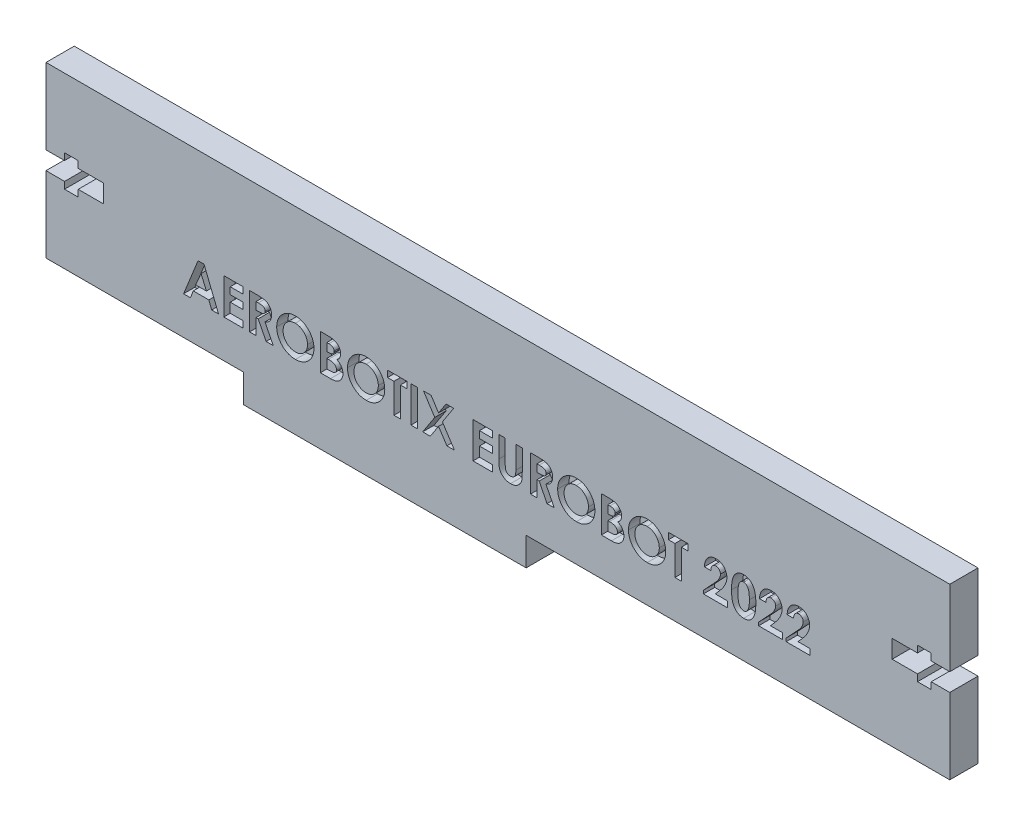
from build123d import *

# Parameters (mm, degrees)
BOSS_EXTRU_1_DEPTH      = 5
ESQUISSE2_W             = 1.13974359
ESQUISSE2_H             = 6.35
ENL_V_MAT_EXTRU_1_DEPTH = 2
ESQUISSE3_W             = 1.329700854
ESQUISSE3_H             = 7.408333334
ENL_V_MAT_EXTRU_2_DEPTH = 1


with BuildPart() as part:
    # Esquisse1 → Boss.-Extru.1 (new body)
    with BuildSketch(Plane.XY):
        Polygon((-54.138176638, -12.407407407), (-54.138176638, -17.407407407), (-4.138176638, -17.407407407), (-4.138176638, -12.407407407), (70.861823362, -12.407407407), (70.861823362, 1.003336668), (67.579973618, 0.992592593), (67.579973618, -0.207407407), (65.159973618, -0.207407407), (65.159973618, 0.992592593), (60.661823362, 0.992592593), (60.661823362, 4.192592593), (65.159973618, 4.192592593), (65.159973618, 5.392592593), (67.579973618, 5.392592593), (67.579973618, 4.192592593), (70.861823362, 4.180092593), (70.861823362, 17.592592593), (-89.138176638, 17.592592593), (-89.138176638, 4.180092593), (-85.856326894, 4.192592593), (-85.856326894, 5.392592593), (-83.436326894, 5.392592593), (-83.436326894, 4.192592593), (-78.938176638, 4.192592593), (-78.938176638, 0.992592593), (-83.436326894, 0.992592593), (-83.436326894, -0.207407407), (-85.856326894, -0.207407407), (-85.856326894, 0.992592593), (-89.138176638, 1.003336668), (-89.138176638, -12.407407407), align=None)
    extrude(amount=BOSS_EXTRU_1_DEPTH)

    # Esquisse2 → Enlèv. mat.-Extru.1 (cut)
    # profile 1 of 20: a face of its own
    with BuildSketch(Plane.XY.offset(5)):
        Polygon((-62.216391782, 0.64796463), (-61.159330484, 0.64796463), (-58.594907407, -5.70203537), (-59.812245148, -5.70203537), (-60.305794827, -4.399471267), (-63.07247151, -4.399471267), (-63.566021189, -5.70203537), (-64.782086895, -5.70203537), align=None)
        Polygon((-61.688497151, -1.055290578), (-62.639979523, -3.259727677), (-60.737014779, -3.259727677), align=None, mode=Mode.SUBTRACT)
    # profile 2 of 20: a face of its own
    with BuildSketch(Plane.XY.offset(5)):
        Polygon((-57.658689459, 0.64796463), (-54.239458689, 0.64796463), (-54.239458689, -0.491778959), (-56.518945869, -0.491778959), (-56.518945869, -1.712932806), (-54.239458689, -1.712932806), (-54.239458689, -2.852676395), (-56.518945869, -2.852676395), (-56.518945869, -4.56229178), (-54.239458689, -4.56229178), (-54.239458689, -5.70203537), (-57.658689459, -5.70203537), align=None)
    # profile 3 of 20: a face of its own
    with BuildSketch(Plane.XY.offset(5)):
        with BuildLine():
            Line((-53.0997151, 0.64796463), (-51.771710292, 0.64796463))
            add(Edge.make_bspline(
                [(-51.771710292, 0.64796463), (-51.683929578, 0.647653059), (-51.51510254, 0.64705382), (-51.271663171, 0.637599415), (-51.048030633, 0.624442833), (-50.843873816, 0.604365541), (-50.659280063, 0.577745478), (-50.494064368, 0.546364829), (-50.348231559, 0.510599851), (-50.220551739, 0.466033868), (-50.105327015, 0.415764114), (-49.997921552, 0.358003245), (-49.895965828, 0.293394446), (-49.800141305, 0.220237686), (-49.709615246, 0.139849035), (-49.624216868, 0.052147576), (-49.54515293, -0.043610365), (-49.472912998, -0.146819718), (-49.407072115, -0.25539359), (-49.348882583, -0.369481055), (-49.30156276, -0.489161452), (-49.259750623, -0.612705142), (-49.229634695, -0.741878204), (-49.208689508, -0.875423119), (-49.193354262, -1.013809977), (-49.192472558, -1.107823864), (-49.192022792, -1.155781363)],
                knots=[0, 0, 0, 0, 1.749336639, 3.364467119, 4.854658419, 6.213483162, 7.451590619, 8.570285859, 9.5643256, 10.440900261, 11.26203566, 12.067320669, 12.869050712, 13.665104639, 14.467235401, 15.27997916, 16.102287765, 16.939272006, 17.78853747, 18.631303466, 19.488103222, 20.351255419, 21.228522269, 22.127379805, 23.044756219, 24, 24, 24, 24], degree=3))
            add(Edge.make_bspline(
                [(-49.192022792, -1.155781363), (-49.193191123, -1.205837975), (-49.195482008, -1.303989868), (-49.207821961, -1.448166994), (-49.230375517, -1.586105582), (-49.26453616, -1.717401767), (-49.303799381, -1.843689683), (-49.356009394, -1.962639238), (-49.414933554, -2.07598038), (-49.484916057, -2.182109858), (-49.561718435, -2.283385018), (-49.651037985, -2.375925634), (-49.747088173, -2.464705413), (-49.855268329, -2.544163491), (-49.97080977, -2.619672536), (-50.096008185, -2.688103839), (-50.230046486, -2.751177607), (-50.324282049, -2.786351897), (-50.37247151, -2.804339056)],
                knots=[0, 0, 0, 0, 1.099860209, 2.156625411, 3.176576793, 4.16617041, 5.135385252, 6.078461593, 7.016046972, 7.938469504, 8.868247731, 9.803980173, 10.76021508, 11.73834243, 12.748633912, 13.790971185, 14.870363756, 16, 16, 16, 16], degree=3))
            Line((-50.37247151, -2.804339056), (-48.907086895, -5.70203537))
            Line((-48.907086895, -5.70203537), (-50.17403401, -5.70203537))
            Line((-50.17403401, -5.70203537), (-51.573272792, -2.934086652))
            Line((-51.573272792, -2.934086652), (-51.95997151, -2.934086652))
            Line((-51.95997151, -2.934086652), (-51.95997151, -5.70203537))
            Line((-51.95997151, -5.70203537), (-53.0997151, -5.70203537))
            Line((-53.0997151, -5.70203537), (-53.0997151, 0.64796463))
        make_face()
        with BuildLine():
            Line((-51.95997151, -1.794343062), (-51.516031205, -1.794343062))
            add(Edge.make_bspline(
                [(-51.516031205, -1.794343062), (-51.461755813, -1.793731776), (-51.357830099, -1.792561295), (-51.208371272, -1.787132118), (-51.072627013, -1.774050483), (-50.950014391, -1.757522327), (-50.839916429, -1.738438184), (-50.743315163, -1.711089449), (-50.658722115, -1.681784586), (-50.587139715, -1.645366244), (-50.525981358, -1.60395069), (-50.473175031, -1.556901591), (-50.429496627, -1.50244825), (-50.393547072, -1.442070474), (-50.365582227, -1.375234236), (-50.345170033, -1.302673246), (-50.333762635, -1.223560942), (-50.332450175, -1.16896268), (-50.331766382, -1.14051694)],
                knots=[0, 0, 0, 0, 1.688639943, 3.233382647, 4.650958383, 5.928841754, 7.082724185, 8.122798841, 9.049171256, 9.863274652, 10.613301712, 11.341792392, 12.054588806, 12.776240173, 13.521029143, 14.301969904, 15.115324896, 16, 16, 16, 16], degree=3))
            add(Edge.make_bspline(
                [(-50.331766382, -1.14051694), (-50.333059155, -1.106863553), (-50.335598567, -1.04075771), (-50.360797431, -0.945588475), (-50.400908579, -0.857502837), (-50.455889976, -0.776898789), (-50.525131898, -0.706235716), (-50.604592467, -0.643945654), (-50.695986633, -0.594691334), (-50.780610753, -0.562203709), (-50.857598923, -0.542766028), (-50.927078316, -0.528281239), (-51.007535873, -0.518015454), (-51.099032333, -0.507126762), (-51.201334468, -0.500065996), (-51.314999888, -0.494913044), (-51.439702145, -0.492804719), (-51.526631463, -0.492130724), (-51.572000757, -0.491778959)],
                knots=[0, 0, 0, 0, 1.020303359, 2.004196876, 2.966617323, 3.9489082, 4.950758222, 5.960522915, 7.003732012, 8.091992268, 8.70421221, 9.413913587, 10.24622431, 11.166358409, 12.212345909, 13.359657661, 14.621978493, 16, 16, 16, 16], degree=3))
            Line((-51.572000757, -0.491778959), (-51.95997151, -0.491778959))
            Line((-51.95997151, -0.491778959), (-51.95997151, -1.794343062))
        make_face(mode=Mode.SUBTRACT)
    # profile 4 of 20: a face of its own
    with BuildSketch(Plane.XY.offset(5)):
        with BuildLine():
            add(Edge.make_bspline(
                [(-44.986674234, 0.810785143), (-44.876271702, 0.807926624), (-44.658312098, 0.802283259), (-44.337772173, 0.755241412), (-44.028872688, 0.678593466), (-43.731753326, 0.572047277), (-43.447158039, 0.432717032), (-43.174082966, 0.264552837), (-42.913506248, 0.064380691), (-42.668098066, -0.163129718), (-42.441296645, -0.410537354), (-42.244773082, -0.676915659), (-42.077184997, -0.955362505), (-41.938287543, -1.246623998), (-41.832491279, -1.552717262), (-41.758249665, -1.872081626), (-41.710553106, -2.204626235), (-41.705067268, -2.431043787), (-41.702279202, -2.546115898)],
                knots=[0, 0, 0, 0, 1.014329547, 2.002516266, 2.970391464, 3.935626869, 4.897733899, 5.877609409, 6.878433252, 7.912639331, 8.949961323, 9.958554974, 10.949718813, 11.932905612, 12.9188844, 13.919928257, 14.942845884, 16, 16, 16, 16], degree=3))
            add(Edge.make_bspline(
                [(-41.702279202, -2.546115898), (-41.705248371, -2.659891413), (-41.711099215, -2.884089714), (-41.756302483, -3.213569794), (-41.831794335, -3.5295131), (-41.935796211, -3.832634779), (-42.07217459, -4.121466614), (-42.236494525, -4.397852754), (-42.433092107, -4.659228271), (-42.65479665, -4.9054529), (-42.898874112, -5.128954586), (-43.157390891, -5.32591506), (-43.429153316, -5.492811933), (-43.713763614, -5.629568758), (-44.011832118, -5.735700693), (-44.322622562, -5.810584486), (-44.646115715, -5.856092879), (-44.866106746, -5.861905505), (-44.977769988, -5.864855882)],
                knots=[0, 0, 0, 0, 1.051557043, 2.072126891, 3.067553643, 4.050577992, 5.02905126, 6.015227836, 7.017913613, 8.04756643, 9.074058332, 10.072836633, 11.047628519, 12.017157415, 12.98668631, 13.966869689, 14.968021931, 16, 16, 16, 16], degree=3))
            add(Edge.make_bspline(
                [(-44.977769988, -5.864855882), (-45.094556349, -5.862209248), (-45.324025585, -5.857008973), (-45.65985484, -5.807556735), (-45.981608284, -5.733064389), (-46.286583003, -5.621888558), (-46.577884904, -5.482909422), (-46.853373707, -5.311748283), (-47.112956829, -5.108687999), (-47.355145258, -4.878929019), (-47.574568562, -4.6275223), (-47.768252668, -4.361933397), (-47.931629507, -4.084191174), (-48.064705058, -3.794165643), (-48.169616477, -3.493659241), (-48.243619563, -3.180841798), (-48.287334952, -2.856463563), (-48.293424252, -2.636139381), (-48.296509972, -2.524491299)],
                knots=[0, 0, 0, 0, 1.067978421, 2.098431617, 3.099715153, 4.085208694, 5.062210972, 6.048429807, 7.046490867, 8.072918869, 9.098532598, 10.095778865, 11.076610158, 12.041847152, 13.011192615, 13.984257998, 14.978533688, 16, 16, 16, 16], degree=3))
            add(Edge.make_bspline(
                [(-48.296509972, -2.524491299), (-48.295541495, -2.449380314), (-48.293616805, -2.300109421), (-48.270431886, -2.078897578), (-48.237052269, -1.862003493), (-48.187685399, -1.650291926), (-48.12771727, -1.44226935), (-48.050020087, -1.239872092), (-47.961579667, -1.040937991), (-47.858245362, -0.847816708), (-47.743347607, -0.662285122), (-47.617983927, -0.485218416), (-47.481839096, -0.318757585), (-47.335351682, -0.161808719), (-47.17801687, -0.015403453), (-47.011904236, 0.122530783), (-46.833792163, 0.248329965), (-46.647578964, 0.365066361), (-46.454314468, 0.47062906), (-46.254785436, 0.560480871), (-46.05310256, 0.638946928), (-45.846571629, 0.700875809), (-45.63740599, 0.751316235), (-45.423371131, 0.784673355), (-45.206400735, 0.807857631), (-45.060090219, 0.80980699), (-44.986674234, 0.810785143)],
                knots=[0, 0, 0, 0, 1.034744296, 2.056386356, 3.06226378, 4.057406941, 5.050368692, 6.043467995, 7.042652155, 8.049140477, 9.059438543, 10.048523776, 11.036952808, 12.020949711, 13.004946614, 13.997082645, 14.994316842, 16.007702937, 17.024872941, 18.026463647, 19.021641123, 20.005082605, 20.995858141, 21.984425357, 22.988620895, 24, 24, 24, 24], degree=3))
        make_face()
        with BuildLine():
            add(Edge.make_bspline(
                [(-45.004482728, -0.328958447), (-45.078783618, -0.330952106), (-45.225423841, -0.334886793), (-45.440518344, -0.364863782), (-45.647016662, -0.41274044), (-45.843774095, -0.482089195), (-46.031643406, -0.57035256), (-46.210957628, -0.677222131), (-46.379233632, -0.80637143), (-46.538715214, -0.950867007), (-46.68278058, -1.111868288), (-46.810066876, -1.284408541), (-46.916585004, -1.468199628), (-47.005794604, -1.661534172), (-47.072949661, -1.86658617), (-47.120782194, -2.081749426), (-47.15101057, -2.307394678), (-47.154820894, -2.461216753), (-47.156766382, -2.539755722)],
                knots=[0, 0, 0, 0, 1.033739768, 2.040188636, 3.016340934, 3.979330865, 4.937572243, 5.900995986, 6.878200029, 7.884839167, 8.891893314, 9.879764717, 10.863503415, 11.843163062, 12.837761627, 13.859916423, 14.907309254, 16, 16, 16, 16], degree=3))
            add(Edge.make_bspline(
                [(-47.156766382, -2.539755722), (-47.154186962, -2.626794567), (-47.149131727, -2.797376281), (-47.113562479, -3.046216289), (-47.052707036, -3.28122098), (-46.96483296, -3.50124098), (-46.855846052, -3.708719447), (-46.720501609, -3.901113436), (-46.56099157, -4.079574915), (-46.438106329, -4.183768159), (-46.375736734, -4.236650754)],
                knots=[0, 0, 0, 0, 1.078454662, 2.113592447, 3.107694534, 4.079536787, 5.043276885, 6.005368276, 6.987637804, 8, 8, 8, 8], degree=3))
            add(Edge.make_bspline(
                [(-46.375736734, -4.236650754), (-46.324644129, -4.275718384), (-46.223610043, -4.352973444), (-46.062337646, -4.451991652), (-45.896258833, -4.536860134), (-45.724120331, -4.605432863), (-45.546285687, -4.659371019), (-45.36277929, -4.697143023), (-45.17386115, -4.720848222), (-45.046105851, -4.723681443), (-44.981586093, -4.725112293)],
                knots=[0, 0, 0, 0, 1.023928204, 2.024787132, 3.009472467, 3.9914905, 4.972207045, 5.96565515, 6.972602802, 8, 8, 8, 8], degree=3))
            add(Edge.make_bspline(
                [(-44.981586093, -4.725112293), (-44.908562809, -4.723101729), (-44.764887201, -4.719145882), (-44.553796799, -4.689537926), (-44.351565782, -4.639430575), (-44.156938684, -4.570690172), (-43.970476722, -4.481318584), (-43.793091185, -4.371134255), (-43.62447107, -4.241490104), (-43.465192666, -4.095096983), (-43.319604675, -3.933461469), (-43.192583999, -3.760000904), (-43.082679127, -3.578537143), (-42.995324642, -3.386501843), (-42.925516441, -3.185707726), (-42.878259597, -2.975265519), (-42.84777586, -2.756042744), (-42.843964462, -2.606853898), (-42.842022792, -2.530851475)],
                knots=[0, 0, 0, 0, 1.026359118, 2.019393844, 2.989460624, 3.950973911, 4.916101784, 5.890408035, 6.881132271, 7.902007068, 8.92769091, 9.933912415, 10.920395702, 11.90457117, 12.894218921, 13.903490204, 14.931958862, 16, 16, 16, 16], degree=3))
            add(Edge.make_bspline(
                [(-42.842022792, -2.530851475), (-42.844031644, -2.455286087), (-42.847985762, -2.306547145), (-42.87764583, -2.087887991), (-42.927435413, -1.878374824), (-42.996382237, -1.677665489), (-43.084423679, -1.485563214), (-43.193295854, -1.302743546), (-43.322616743, -1.129383227), (-43.469410034, -0.96666364), (-43.629185508, -0.817134763), (-43.800720445, -0.687370879), (-43.979215103, -0.57461019), (-44.168765022, -0.486278019), (-44.365492169, -0.415903966), (-44.570596982, -0.364079503), (-44.78485631, -0.335097383), (-44.93062136, -0.331022999), (-45.004482728, -0.328958447)],
                knots=[0, 0, 0, 0, 1.055025985, 2.07665775, 3.074803781, 4.057872707, 5.035505728, 6.020516407, 7.023567878, 8.050795229, 9.077271434, 10.074415901, 11.050397877, 12.019801805, 12.988065821, 13.964604439, 14.968634123, 16, 16, 16, 16], degree=3))
        make_face(mode=Mode.SUBTRACT)
    # profile 5 of 20: a face of its own
    with BuildSketch(Plane.XY.offset(5)):
        with BuildLine():
            Line((-40.562535613, -5.70203537), (-40.562535613, 0.64796463))
            Line((-40.562535613, 0.64796463), (-39.544907407, 0.64796463))
            add(Edge.make_bspline(
                [(-39.544907407, 0.64796463), (-39.47366707, 0.647972761), (-39.335818368, 0.647988493), (-39.136938666, 0.64100449), (-38.952494539, 0.631969901), (-38.783072958, 0.621862297), (-38.628385557, 0.604444875), (-38.488667563, 0.586088815), (-38.363639819, 0.563952538), (-38.286341959, 0.544095611), (-38.249975516, 0.534753493)],
                knots=[0, 0, 0, 0, 1.311965854, 2.538629056, 3.664479157, 4.713267157, 5.663616078, 6.530575999, 7.308677837, 8, 8, 8, 8], degree=3))
            add(Edge.make_bspline(
                [(-38.249975516, 0.534753493), (-38.202222685, 0.521576268), (-38.108516299, 0.495718323), (-37.974298851, 0.443497085), (-37.846974879, 0.385449477), (-37.726699842, 0.319228012), (-37.614212278, 0.244033213), (-37.509939676, 0.159268311), (-37.411633136, 0.068335764), (-37.322783297, -0.03129869), (-37.242477682, -0.136580947), (-37.172706501, -0.24748342), (-37.112084287, -0.362310339), (-37.063570637, -0.482506722), (-37.027016513, -0.607519034), (-37.000280979, -0.736813452), (-36.982952733, -0.870799096), (-36.981315441, -0.961953909), (-36.98048433, -1.008225273)],
                knots=[0, 0, 0, 0, 1.099996261, 2.158545794, 3.195537121, 4.207578794, 5.205712374, 6.197378256, 7.190519799, 8.17788031, 9.159561366, 10.129234751, 11.085776129, 12.040971148, 13.00380137, 13.975669004, 14.972423361, 16, 16, 16, 16], degree=3))
            add(Edge.make_bspline(
                [(-36.98048433, -1.008225273), (-36.982657438, -1.067671831), (-36.986934933, -1.184685075), (-37.014259861, -1.35655636), (-37.065498359, -1.518999428), (-37.132542688, -1.675008044), (-37.223702014, -1.824000293), (-37.339456728, -1.965905336), (-37.477931982, -2.105092639), (-37.584150147, -2.188526039), (-37.639398593, -2.23192319)],
                knots=[0, 0, 0, 0, 0.986156485, 1.941127874, 2.875419072, 3.804401753, 4.751181392, 5.761612777, 6.835722519, 8, 8, 8, 8], degree=3))
            add(Edge.make_bspline(
                [(-37.639398593, -2.23192319), (-37.594627903, -2.254778239), (-37.506844965, -2.299590668), (-37.382218983, -2.373248923), (-37.266828927, -2.451593819), (-37.160157424, -2.533049025), (-37.06444203, -2.621067546), (-36.975730497, -2.710577633), (-36.89839939, -2.806707842), (-36.829247584, -2.90603191), (-36.769141958, -3.00998806), (-36.716796586, -3.118400734), (-36.672582328, -3.231640293), (-36.63514055, -3.34913044), (-36.607216463, -3.471275285), (-36.589009364, -3.598118514), (-36.575068871, -3.729227525), (-36.573984431, -3.818535709), (-36.573433048, -3.863944424)],
                knots=[0, 0, 0, 0, 1.164658916, 2.283573913, 3.35186032, 4.395461096, 5.390182219, 6.362969632, 7.312859996, 8.245001507, 9.165155236, 10.092416118, 11.032087915, 11.979892451, 12.947605196, 13.931445124, 14.948243989, 16, 16, 16, 16], degree=3))
            add(Edge.make_bspline(
                [(-36.573433048, -3.863944424), (-36.577011154, -3.950672474), (-36.584072532, -4.121829933), (-36.63570188, -4.373128392), (-36.725210764, -4.611382123), (-36.845402737, -4.835644205), (-36.993502374, -5.039422619), (-37.163774486, -5.21793074), (-37.354504824, -5.369033902), (-37.530476613, -5.471016813), (-37.682678353, -5.539456884), (-37.80874421, -5.581770852), (-37.944136269, -5.620970447), (-38.091334586, -5.648497213), (-38.247670658, -5.673692735), (-38.414668769, -5.689248973), (-38.592016805, -5.699791052), (-38.713827102, -5.701272139), (-38.776598113, -5.70203537)],
                knots=[0, 0, 0, 0, 1.284142165, 2.534249414, 3.780121997, 5.041676246, 6.291546858, 7.49970053, 8.684500223, 9.883330709, 10.50184324, 11.153274765, 11.851151195, 12.587658647, 13.369265475, 14.195992086, 15.070362669, 16, 16, 16, 16], degree=3))
            Line((-38.776598113, -5.70203537), (-40.562535613, -5.70203537))
        make_face()
        with BuildLine():
            Line((-39.422792023, -0.491778959), (-39.422792023, -1.875753318))
            Line((-39.422792023, -1.875753318), (-39.120047632, -1.875753318))
            add(Edge.make_bspline(
                [(-39.120047632, -1.875753318), (-39.078901949, -1.875394512), (-38.999472699, -1.874701859), (-38.884745571, -1.865780728), (-38.778067871, -1.850560723), (-38.679844203, -1.829324988), (-38.589159577, -1.8023587), (-38.506593315, -1.769912449), (-38.432508443, -1.730324495), (-38.346438958, -1.671356491), (-38.255457305, -1.584582434), (-38.175367179, -1.459219329), (-38.12819463, -1.315052235), (-38.12294088, -1.213374438), (-38.12022792, -1.160869504)],
                knots=[0, 0, 0, 0, 1.065314748, 2.056525647, 2.977365736, 3.853934255, 4.656397591, 5.425096493, 6.14721249, 6.826394842, 8.123232004, 9.372140726, 10.643011755, 12, 12, 12, 12], degree=3))
            add(Edge.make_bspline(
                [(-38.12022792, -1.160869504), (-38.122398785, -1.111689911), (-38.126596064, -1.016603143), (-38.174092756, -0.883092852), (-38.247864509, -0.76477541), (-38.334962432, -0.683796797), (-38.416982051, -0.628490791), (-38.487212282, -0.592074142), (-38.564295235, -0.55947433), (-38.649723151, -0.534547719), (-38.743008192, -0.515843667), (-38.84369722, -0.502107782), (-38.951963958, -0.492758554), (-39.026744024, -0.492112495), (-39.065350116, -0.491778959)],
                knots=[0, 0, 0, 0, 1.347982417, 2.606269829, 3.849316587, 5.153353503, 5.842674298, 6.568177932, 7.326619318, 8.142485038, 9.012069166, 9.942760135, 10.937925643, 12, 12, 12, 12], degree=3))
            Line((-39.065350116, -0.491778959), (-39.422792023, -0.491778959))
        make_face(mode=Mode.SUBTRACT)
        with BuildLine():
            Line((-39.422792023, -2.934086652), (-39.422792023, -4.56229178))
            Line((-39.422792023, -4.56229178), (-39.094606927, -4.56229178))
            add(Edge.make_bspline(
                [(-39.094606927, -4.56229178), (-39.029724315, -4.561921108), (-38.904979399, -4.561208445), (-38.726282526, -4.55259778), (-38.563802395, -4.537078574), (-38.417969517, -4.517704096), (-38.288560519, -4.491454708), (-38.176012837, -4.458081975), (-38.078783024, -4.421366157), (-37.997454075, -4.376017761), (-37.931012983, -4.323243475), (-37.871056863, -4.269306886), (-37.822172379, -4.207085935), (-37.783494063, -4.139251595), (-37.750018049, -4.06748892), (-37.729827681, -3.988995604), (-37.714455443, -3.906097999), (-37.713609468, -3.848759518), (-37.713176638, -3.81942319)],
                knots=[0, 0, 0, 0, 1.753078804, 3.370512758, 4.83203934, 6.162291463, 7.344201807, 8.395507345, 9.331626367, 10.147333109, 10.898971645, 11.62040215, 12.321813352, 13.025280112, 13.727906689, 14.453419512, 15.208716525, 16, 16, 16, 16], degree=3))
            add(Edge.make_bspline(
                [(-37.713176638, -3.81942319), (-37.714131152, -3.785876638), (-37.715990289, -3.720536979), (-37.731173883, -3.625036093), (-37.758767433, -3.53587968), (-37.793522856, -3.45078789), (-37.841886873, -3.372807305), (-37.899365855, -3.299239312), (-37.968815138, -3.232575152), (-38.046914908, -3.168782726), (-38.138010558, -3.112929001), (-38.242144827, -3.064466001), (-38.359883429, -3.023991489), (-38.491591072, -2.991765655), (-38.636690359, -2.964416035), (-38.796240356, -2.948085293), (-38.968912275, -2.935939403), (-39.088645794, -2.934718268), (-39.150576478, -2.934086652)],
                knots=[0, 0, 0, 0, 0.845221588, 1.646264278, 2.427170338, 3.19324141, 3.95557735, 4.731569926, 5.540061037, 6.376114724, 7.268642756, 8.224665384, 9.265483498, 10.400594375, 11.639216012, 12.983232105, 14.439614077, 16, 16, 16, 16], degree=3))
            Line((-39.150576478, -2.934086652), (-39.422792023, -2.934086652))
        make_face(mode=Mode.SUBTRACT)
    # profile 6 of 20: a face of its own
    with BuildSketch(Plane.XY.offset(5)):
        with BuildLine():
            add(Edge.make_bspline(
                [(-32.449494747, 0.810785143), (-32.339092215, 0.807926624), (-32.12113261, 0.802283259), (-31.800592686, 0.755241412), (-31.4916932, 0.678593466), (-31.194573838, 0.572047277), (-30.909978552, 0.432717032), (-30.636903479, 0.264552837), (-30.376326761, 0.064380691), (-30.130918579, -0.163129718), (-29.904117158, -0.410537354), (-29.707593595, -0.676915659), (-29.540005509, -0.955362505), (-29.401108056, -1.246623998), (-29.295311792, -1.552717262), (-29.221070178, -1.872081626), (-29.173373619, -2.204626235), (-29.167887781, -2.431043787), (-29.165099715, -2.546115898)],
                knots=[0, 0, 0, 0, 1.014329547, 2.002516266, 2.970391464, 3.935626869, 4.897733899, 5.877609409, 6.878433252, 7.912639331, 8.949961323, 9.958554974, 10.949718813, 11.932905612, 12.9188844, 13.919928257, 14.942845884, 16, 16, 16, 16], degree=3))
            add(Edge.make_bspline(
                [(-29.165099715, -2.546115898), (-29.168068884, -2.659891413), (-29.173919727, -2.884089714), (-29.219122995, -3.213569794), (-29.294614848, -3.5295131), (-29.398616724, -3.832634779), (-29.534995103, -4.121466614), (-29.699315038, -4.397852754), (-29.89591262, -4.659228271), (-30.117617163, -4.9054529), (-30.361694625, -5.128954586), (-30.620211404, -5.32591506), (-30.891973829, -5.492811933), (-31.176584127, -5.629568758), (-31.474652631, -5.735700693), (-31.785443075, -5.810584486), (-32.108936228, -5.856092879), (-32.328927259, -5.861905505), (-32.4405905, -5.864855882)],
                knots=[0, 0, 0, 0, 1.051557043, 2.072126891, 3.067553643, 4.050577992, 5.02905126, 6.015227836, 7.017913613, 8.04756643, 9.074058332, 10.072836633, 11.047628519, 12.017157415, 12.98668631, 13.966869689, 14.968021931, 16, 16, 16, 16], degree=3))
            add(Edge.make_bspline(
                [(-32.4405905, -5.864855882), (-32.557376861, -5.862209248), (-32.786846098, -5.857008973), (-33.122675353, -5.807556735), (-33.444428797, -5.733064389), (-33.749403516, -5.621888558), (-34.040705417, -5.482909422), (-34.31619422, -5.311748283), (-34.575777342, -5.108687999), (-34.817965771, -4.878929019), (-35.037389075, -4.6275223), (-35.23107318, -4.361933397), (-35.39445002, -4.084191174), (-35.527525571, -3.794165643), (-35.63243699, -3.493659241), (-35.706440076, -3.180841798), (-35.750155465, -2.856463563), (-35.756244765, -2.636139381), (-35.759330484, -2.524491299)],
                knots=[0, 0, 0, 0, 1.067978421, 2.098431617, 3.099715153, 4.085208694, 5.062210972, 6.048429807, 7.046490867, 8.072918869, 9.098532598, 10.095778865, 11.076610158, 12.041847152, 13.011192615, 13.984257998, 14.978533688, 16, 16, 16, 16], degree=3))
            add(Edge.make_bspline(
                [(-35.759330484, -2.524491299), (-35.758362008, -2.449380314), (-35.756437318, -2.300109421), (-35.733252399, -2.078897578), (-35.699872782, -1.862003493), (-35.650505912, -1.650291926), (-35.590537783, -1.44226935), (-35.5128406, -1.239872092), (-35.42440018, -1.040937991), (-35.321065875, -0.847816708), (-35.20616812, -0.662285122), (-35.08080444, -0.485218416), (-34.944659609, -0.318757585), (-34.798172195, -0.161808719), (-34.640837383, -0.015403453), (-34.474724749, 0.122530783), (-34.296612676, 0.248329965), (-34.110399477, 0.365066361), (-33.917134981, 0.47062906), (-33.717605949, 0.560480871), (-33.515923073, 0.638946928), (-33.309392142, 0.700875809), (-33.100226503, 0.751316235), (-32.886191643, 0.784673355), (-32.669221247, 0.807857631), (-32.522910732, 0.80980699), (-32.449494747, 0.810785143)],
                knots=[0, 0, 0, 0, 1.034744296, 2.056386356, 3.06226378, 4.057406941, 5.050368692, 6.043467995, 7.042652155, 8.049140477, 9.059438543, 10.048523776, 11.036952808, 12.020949711, 13.004946614, 13.997082645, 14.994316842, 16.007702937, 17.024872941, 18.026463647, 19.021641123, 20.005082605, 20.995858141, 21.984425357, 22.988620895, 24, 24, 24, 24], degree=3))
        make_face()
        with BuildLine():
            add(Edge.make_bspline(
                [(-32.467303241, -0.328958447), (-32.54160413, -0.330952106), (-32.688244354, -0.334886793), (-32.903338857, -0.364863782), (-33.109837175, -0.41274044), (-33.306594608, -0.482089195), (-33.494463918, -0.57035256), (-33.673778141, -0.677222131), (-33.842054145, -0.80637143), (-34.001535727, -0.950867007), (-34.145601093, -1.111868288), (-34.272887389, -1.284408541), (-34.379405517, -1.468199628), (-34.468615117, -1.661534172), (-34.535770173, -1.86658617), (-34.583602707, -2.081749426), (-34.613831083, -2.307394678), (-34.617641407, -2.461216753), (-34.619586895, -2.539755722)],
                knots=[0, 0, 0, 0, 1.033739768, 2.040188636, 3.016340934, 3.979330865, 4.937572243, 5.900995986, 6.878200029, 7.884839167, 8.891893314, 9.879764717, 10.863503415, 11.843163062, 12.837761627, 13.859916423, 14.907309254, 16, 16, 16, 16], degree=3))
            add(Edge.make_bspline(
                [(-34.619586895, -2.539755722), (-34.617007475, -2.626794567), (-34.61195224, -2.797376281), (-34.576382992, -3.046216289), (-34.515527549, -3.28122098), (-34.427653473, -3.50124098), (-34.318666565, -3.708719447), (-34.183322122, -3.901113436), (-34.023812083, -4.079574915), (-33.900926842, -4.183768159), (-33.838557247, -4.236650754)],
                knots=[0, 0, 0, 0, 1.078454662, 2.113592447, 3.107694534, 4.079536787, 5.043276885, 6.005368276, 6.987637804, 8, 8, 8, 8], degree=3))
            add(Edge.make_bspline(
                [(-33.838557247, -4.236650754), (-33.787464642, -4.275718384), (-33.686430556, -4.352973444), (-33.525158159, -4.451991652), (-33.359079345, -4.536860134), (-33.186940843, -4.605432863), (-33.0091062, -4.659371019), (-32.825599802, -4.697143023), (-32.636681663, -4.720848222), (-32.508926364, -4.723681443), (-32.444406606, -4.725112293)],
                knots=[0, 0, 0, 0, 1.023928204, 2.024787132, 3.009472467, 3.9914905, 4.972207045, 5.96565515, 6.972602802, 8, 8, 8, 8], degree=3))
            add(Edge.make_bspline(
                [(-32.444406606, -4.725112293), (-32.371383322, -4.723101729), (-32.227707714, -4.719145882), (-32.016617312, -4.689537926), (-31.814386295, -4.639430575), (-31.619759197, -4.570690172), (-31.433297234, -4.481318584), (-31.255911698, -4.371134255), (-31.087291583, -4.241490104), (-30.928013179, -4.095096983), (-30.782425187, -3.933461469), (-30.655404512, -3.760000904), (-30.545499639, -3.578537143), (-30.458145155, -3.386501843), (-30.388336953, -3.185707726), (-30.341080109, -2.975265519), (-30.310596372, -2.756042744), (-30.306784975, -2.606853898), (-30.304843305, -2.530851475)],
                knots=[0, 0, 0, 0, 1.026359118, 2.019393844, 2.989460624, 3.950973911, 4.916101784, 5.890408035, 6.881132271, 7.902007068, 8.92769091, 9.933912415, 10.920395702, 11.90457117, 12.894218921, 13.903490204, 14.931958862, 16, 16, 16, 16], degree=3))
            add(Edge.make_bspline(
                [(-30.304843305, -2.530851475), (-30.306852157, -2.455286087), (-30.310806275, -2.306547145), (-30.340466343, -2.087887991), (-30.390255926, -1.878374824), (-30.459202749, -1.677665489), (-30.547244192, -1.485563214), (-30.656116367, -1.302743546), (-30.785437256, -1.129383227), (-30.932230547, -0.96666364), (-31.092006021, -0.817134763), (-31.263540958, -0.687370879), (-31.442035616, -0.57461019), (-31.631585535, -0.486278019), (-31.828312681, -0.415903966), (-32.033417495, -0.364079503), (-32.247676823, -0.335097383), (-32.393441873, -0.331022999), (-32.467303241, -0.328958447)],
                knots=[0, 0, 0, 0, 1.055025985, 2.07665775, 3.074803781, 4.057872707, 5.035505728, 6.020516407, 7.023567878, 8.050795229, 9.077271434, 10.074415901, 11.050397877, 12.019801805, 12.988065821, 13.964604439, 14.968634123, 16, 16, 16, 16], degree=3))
        make_face(mode=Mode.SUBTRACT)
    # profile 7 of 20: a face of its own
    with BuildSketch(Plane.XY.offset(5)):
        Polygon((-28.676638177, 0.64796463), (-25.257407407, 0.64796463), (-25.257407407, -0.491778959), (-26.397150997, -0.491778959), (-26.397150997, -5.70203537), (-27.536894587, -5.70203537), (-27.536894587, -0.491778959), (-28.676638177, -0.491778959), align=None)
    # profile 8 of 20: a face of its own
    with BuildSketch(Plane.XY.offset(5)):
        with Locations((-23.954843305, -2.52703537)):
            Rectangle(ESQUISSE2_W, ESQUISSE2_H)
    # profile 9 of 20: a face of its own
    with BuildSketch(Plane.XY.offset(5)):
        Polygon((-22.307557648, 0.64796463), (-20.964288417, 0.64796463), (-19.637555645, -1.391107886), (-18.308278802, 0.64796463), (-16.963737536, 0.64796463), (-18.965921029, -2.422728479), (-16.831445869, -5.70203537), (-18.1747151, -5.70203537), (-19.637555645, -3.453077036), (-21.104212295, -5.70203537), (-22.448753561, -5.70203537), (-20.30919026, -2.421456443), align=None)
    # profile 10 of 20: a face of its own
    with BuildSketch(Plane.XY.offset(5)):
        Polygon((-13.534330484, 0.64796463), (-10.115099715, 0.64796463), (-10.115099715, -0.491778959), (-12.394586895, -0.491778959), (-12.394586895, -1.712932806), (-10.115099715, -1.712932806), (-10.115099715, -2.852676395), (-12.394586895, -2.852676395), (-12.394586895, -4.56229178), (-10.115099715, -4.56229178), (-10.115099715, -5.70203537), (-13.534330484, -5.70203537), align=None)
    # profile 11 of 20: a face of its own
    with BuildSketch(Plane.XY.offset(5)):
        with BuildLine():
            Line((-8.975356125, 0.64796463), (-7.835612536, 0.64796463))
            Line((-7.835612536, 0.64796463), (-7.835612536, -3.483605882))
            add(Edge.make_bspline(
                [(-7.835612536, -3.483605882), (-7.835550562, -3.526440214), (-7.835430861, -3.609174281), (-7.829438544, -3.727870581), (-7.823955162, -3.836977334), (-7.814061583, -3.936375089), (-7.799445376, -4.026106367), (-7.785292119, -4.106747569), (-7.766137085, -4.176854906), (-7.73735013, -4.25665541), (-7.692998884, -4.346315634), (-7.620531408, -4.439761577), (-7.53691014, -4.525044563), (-7.436685234, -4.59603089), (-7.324041304, -4.65345243), (-7.199597277, -4.695995436), (-7.063528575, -4.719643699), (-6.969444532, -4.723254039), (-6.921019186, -4.725112293)],
                knots=[0, 0, 0, 0, 1.155499968, 2.231836252, 3.205919964, 4.102923608, 4.924856345, 5.658536265, 6.31071849, 6.882491295, 7.94666036, 8.992281882, 10.060072772, 11.158554251, 12.289267114, 13.461410017, 14.693379945, 16, 16, 16, 16], degree=3))
            add(Edge.make_bspline(
                [(-6.921019186, -4.725112293), (-6.869573232, -4.723611063), (-6.769262332, -4.720683918), (-6.624981072, -4.691950825), (-6.491303665, -4.6461979), (-6.37106052, -4.580896816), (-6.264371297, -4.502622023), (-6.174061106, -4.413364229), (-6.102788634, -4.312945411), (-6.056335889, -4.220301404), (-6.03025496, -4.135030663), (-6.010706005, -4.058844492), (-5.996374458, -3.968952352), (-5.983372407, -3.866758102), (-5.975559177, -3.751203206), (-5.967087002, -3.623216972), (-5.963981871, -3.481923684), (-5.963452624, -3.383538516), (-5.963176638, -3.332233687)],
                knots=[0, 0, 0, 0, 1.261321664, 2.459363699, 3.594844139, 4.716940403, 5.803436589, 6.833651888, 7.818396249, 8.814403945, 9.360733334, 10.004355033, 10.743453831, 11.592799886, 12.532235708, 13.585170094, 14.740740724, 16, 16, 16, 16], degree=3))
            Line((-5.963176638, -3.332233687), (-5.963176638, 0.64796463))
            Line((-5.963176638, 0.64796463), (-4.823433048, 0.64796463))
            Line((-4.823433048, 0.64796463), (-4.823433048, -3.140156363))
            add(Edge.make_bspline(
                [(-4.823433048, -3.140156363), (-4.823591323, -3.216903513), (-4.823895668, -3.364480799), (-4.8285695, -3.576559743), (-4.838519244, -3.770259839), (-4.84687588, -3.945637686), (-4.863048834, -4.102457022), (-4.879897258, -4.241387509), (-4.901372023, -4.361936809), (-4.933325183, -4.499167537), (-4.988466878, -4.657183695), (-5.077362519, -4.839132451), (-5.190209781, -5.017271304), (-5.323589605, -5.189640604), (-5.474187627, -5.349766129), (-5.638664767, -5.490335614), (-5.814407891, -5.60924224), (-6.00325339, -5.703578596), (-6.205040545, -5.777153843), (-6.421765891, -5.826592703), (-6.653281638, -5.859994217), (-6.81319394, -5.863202844), (-6.895578481, -5.864855882)],
                knots=[0, 0, 0, 0, 1.170808336, 2.251350247, 3.235597562, 4.129743112, 4.929140599, 5.639994148, 6.264258765, 6.79612947, 7.788252245, 8.809469599, 9.879094798, 10.999557536, 12.129761673, 13.226370002, 14.293821979, 15.358369427, 16.438775801, 17.562147481, 18.744053101, 20, 20, 20, 20], degree=3))
            add(Edge.make_bspline(
                [(-6.895578481, -5.864855882), (-6.950316409, -5.863933894), (-7.058313218, -5.862114831), (-7.217141471, -5.846075441), (-7.370680177, -5.822439412), (-7.518640839, -5.78795688), (-7.661537, -5.743411889), (-7.799330696, -5.688580107), (-7.931509852, -5.623767379), (-8.057334812, -5.549569842), (-8.176650738, -5.469337978), (-8.285699336, -5.38039758), (-8.388233223, -5.289326125), (-8.481290239, -5.192290941), (-8.565569324, -5.090310731), (-8.640896906, -4.983154375), (-8.707161072, -4.87083139), (-8.766028662, -4.751317162), (-8.816413573, -4.618537214), (-8.858889947, -4.467768508), (-8.895998306, -4.296647896), (-8.923575049, -4.104789851), (-8.948576286, -3.892826717), (-8.964400691, -3.660206297), (-8.972679149, -3.406921917), (-8.974441252, -3.231325108), (-8.975356125, -3.140156363)],
                knots=[0, 0, 0, 0, 1.001158378, 1.975264943, 2.917723546, 3.841610987, 4.75185031, 5.653588123, 6.552117133, 7.442167995, 8.324307438, 9.179605724, 10.014504199, 10.831958861, 11.636465792, 12.43274043, 13.225645099, 14.020104002, 14.867201867, 15.819789774, 16.883317127, 18.068162734, 19.364263498, 20.787406516, 22.332041935, 24, 24, 24, 24], degree=3))
            Line((-8.975356125, -3.140156363), (-8.975356125, 0.64796463))
        make_face()
    # profile 12 of 20: a face of its own
    with BuildSketch(Plane.XY.offset(5)):
        with BuildLine():
            Line((-3.358048433, 0.64796463), (-2.030043625, 0.64796463))
            add(Edge.make_bspline(
                [(-2.030043625, 0.64796463), (-1.942262912, 0.647653059), (-1.773435873, 0.64705382), (-1.529996505, 0.637599415), (-1.306363966, 0.624442833), (-1.10220715, 0.604365541), (-0.917613397, 0.577745478), (-0.752397701, 0.546364829), (-0.606564893, 0.510599851), (-0.478885072, 0.466033868), (-0.363660348, 0.415764114), (-0.256254886, 0.358003245), (-0.154299161, 0.293394446), (-0.058474638, 0.220237686), (0.032051421, 0.139849035), (0.117449799, 0.052147576), (0.196513737, -0.043610365), (0.268753669, -0.146819718), (0.334594552, -0.25539359), (0.392784083, -0.369481055), (0.440103907, -0.489161452), (0.481916044, -0.612705142), (0.512031971, -0.741878204), (0.532977158, -0.875423119), (0.548312405, -1.013809977), (0.549194108, -1.107823864), (0.549643875, -1.155781363)],
                knots=[0, 0, 0, 0, 1.749336639, 3.364467119, 4.854658419, 6.213483162, 7.451590619, 8.570285859, 9.5643256, 10.440900261, 11.26203566, 12.067320669, 12.869050712, 13.665104639, 14.467235401, 15.27997916, 16.102287765, 16.939272006, 17.78853747, 18.631303466, 19.488103222, 20.351255419, 21.228522269, 22.127379805, 23.044756219, 24, 24, 24, 24], degree=3))
            add(Edge.make_bspline(
                [(0.549643875, -1.155781363), (0.548475543, -1.205837975), (0.546184658, -1.303989868), (0.533844706, -1.448166994), (0.511291149, -1.586105582), (0.477130507, -1.717401767), (0.437867286, -1.843689683), (0.385657273, -1.962639238), (0.326733113, -2.07598038), (0.25675061, -2.182109858), (0.179948231, -2.283385018), (0.090628681, -2.375925634), (-0.005421506, -2.464705413), (-0.113601662, -2.544163491), (-0.229143104, -2.619672536), (-0.354341519, -2.688103839), (-0.488379819, -2.751177607), (-0.582615382, -2.786351897), (-0.630804843, -2.804339056)],
                knots=[0, 0, 0, 0, 1.099860209, 2.156625411, 3.176576793, 4.16617041, 5.135385252, 6.078461593, 7.016046972, 7.938469504, 8.868247731, 9.803980173, 10.76021508, 11.73834243, 12.748633912, 13.790971185, 14.870363756, 16, 16, 16, 16], degree=3))
            Line((-0.630804843, -2.804339056), (0.834579772, -5.70203537))
            Line((0.834579772, -5.70203537), (-0.432367343, -5.70203537))
            Line((-0.432367343, -5.70203537), (-1.831606125, -2.934086652))
            Line((-1.831606125, -2.934086652), (-2.218304843, -2.934086652))
            Line((-2.218304843, -2.934086652), (-2.218304843, -5.70203537))
            Line((-2.218304843, -5.70203537), (-3.358048433, -5.70203537))
            Line((-3.358048433, -5.70203537), (-3.358048433, 0.64796463))
        make_face()
        with BuildLine():
            Line((-2.218304843, -1.794343062), (-1.774364539, -1.794343062))
            add(Edge.make_bspline(
                [(-1.774364539, -1.794343062), (-1.720089146, -1.793731776), (-1.616163432, -1.792561295), (-1.466704605, -1.787132118), (-1.330960346, -1.774050483), (-1.208347724, -1.757522327), (-1.098249762, -1.738438184), (-1.001648496, -1.711089449), (-0.917055448, -1.681784586), (-0.845473049, -1.645366244), (-0.784314691, -1.60395069), (-0.731508364, -1.556901591), (-0.68782996, -1.50244825), (-0.651880405, -1.442070474), (-0.62391556, -1.375234236), (-0.603503366, -1.302673246), (-0.592095968, -1.223560942), (-0.590783508, -1.16896268), (-0.590099715, -1.14051694)],
                knots=[0, 0, 0, 0, 1.688639943, 3.233382647, 4.650958383, 5.928841754, 7.082724185, 8.122798841, 9.049171256, 9.863274652, 10.613301712, 11.341792392, 12.054588806, 12.776240173, 13.521029143, 14.301969904, 15.115324896, 16, 16, 16, 16], degree=3))
            add(Edge.make_bspline(
                [(-0.590099715, -1.14051694), (-0.591392488, -1.106863553), (-0.593931901, -1.04075771), (-0.619130764, -0.945588475), (-0.659241912, -0.857502837), (-0.71422331, -0.776898789), (-0.783465232, -0.706235716), (-0.8629258, -0.643945654), (-0.954319966, -0.594691334), (-1.038944087, -0.562203709), (-1.115932256, -0.542766028), (-1.18541165, -0.528281239), (-1.265869206, -0.518015454), (-1.357365666, -0.507126762), (-1.459667802, -0.500065996), (-1.573333221, -0.494913044), (-1.698035479, -0.492804719), (-1.784964796, -0.492130724), (-1.83033409, -0.491778959)],
                knots=[0, 0, 0, 0, 1.020303359, 2.004196876, 2.966617323, 3.9489082, 4.950758222, 5.960522915, 7.003732012, 8.091992268, 8.70421221, 9.413913587, 10.24622431, 11.166358409, 12.212345909, 13.359657661, 14.621978493, 16, 16, 16, 16], degree=3))
            Line((-1.83033409, -0.491778959), (-2.218304843, -0.491778959))
            Line((-2.218304843, -0.491778959), (-2.218304843, -1.794343062))
        make_face(mode=Mode.SUBTRACT)
    # profile 13 of 20: a face of its own
    with BuildSketch(Plane.XY.offset(5)):
        with BuildLine():
            add(Edge.make_bspline(
                [(4.754992432, 0.810785143), (4.865394965, 0.807926624), (5.083354569, 0.802283259), (5.403894494, 0.755241412), (5.712793979, 0.678593466), (6.009913341, 0.572047277), (6.294508627, 0.432717032), (6.567583701, 0.264552837), (6.828160419, 0.064380691), (7.073568601, -0.163129718), (7.300370022, -0.410537354), (7.496893585, -0.676915659), (7.66448167, -0.955362505), (7.803379123, -1.246623998), (7.909175387, -1.552717262), (7.983417002, -1.872081626), (8.031113561, -2.204626235), (8.036599399, -2.431043787), (8.039387464, -2.546115898)],
                knots=[0, 0, 0, 0, 1.014329547, 2.002516266, 2.970391464, 3.935626869, 4.897733899, 5.877609409, 6.878433252, 7.912639331, 8.949961323, 9.958554974, 10.949718813, 11.932905612, 12.9188844, 13.919928257, 14.942845884, 16, 16, 16, 16], degree=3))
            add(Edge.make_bspline(
                [(8.039387464, -2.546115898), (8.036418295, -2.659891413), (8.030567452, -2.884089714), (7.985364184, -3.213569794), (7.909872332, -3.5295131), (7.805870455, -3.832634779), (7.669492077, -4.121466614), (7.505172142, -4.397852754), (7.30857456, -4.659228271), (7.086870016, -4.9054529), (6.842792554, -5.128954586), (6.584275776, -5.32591506), (6.312513351, -5.492811933), (6.027903053, -5.629568758), (5.729834549, -5.735700693), (5.419044105, -5.810584486), (5.095550952, -5.856092879), (4.87555992, -5.861905505), (4.763896679, -5.864855882)],
                knots=[0, 0, 0, 0, 1.051557043, 2.072126891, 3.067553643, 4.050577992, 5.02905126, 6.015227836, 7.017913613, 8.04756643, 9.074058332, 10.072836633, 11.047628519, 12.017157415, 12.98668631, 13.966869689, 14.968021931, 16, 16, 16, 16], degree=3))
            add(Edge.make_bspline(
                [(4.763896679, -5.864855882), (4.647110318, -5.862209248), (4.417641082, -5.857008973), (4.081811827, -5.807556735), (3.760058383, -5.733064389), (3.455083664, -5.621888558), (3.163781762, -5.482909422), (2.88829296, -5.311748283), (2.628709838, -5.108687999), (2.386521408, -4.878929019), (2.167098105, -4.6275223), (1.973413999, -4.361933397), (1.810037159, -4.084191174), (1.676961608, -3.794165643), (1.572050189, -3.493659241), (1.498047103, -3.180841798), (1.454331715, -2.856463563), (1.448242415, -2.636139381), (1.445156695, -2.524491299)],
                knots=[0, 0, 0, 0, 1.067978421, 2.098431617, 3.099715153, 4.085208694, 5.062210972, 6.048429807, 7.046490867, 8.072918869, 9.098532598, 10.095778865, 11.076610158, 12.041847152, 13.011192615, 13.984257998, 14.978533688, 16, 16, 16, 16], degree=3))
            add(Edge.make_bspline(
                [(1.445156695, -2.524491299), (1.446125172, -2.449380314), (1.448049862, -2.300109421), (1.47123478, -2.078897578), (1.504614398, -1.862003493), (1.553981268, -1.650291926), (1.613949397, -1.44226935), (1.691646579, -1.239872092), (1.780087, -1.040937991), (1.883421304, -0.847816708), (1.998319059, -0.662285122), (2.123682739, -0.485218416), (2.25982757, -0.318757585), (2.406314984, -0.161808719), (2.563649797, -0.015403453), (2.729762431, 0.122530783), (2.907874504, 0.248329965), (3.094087702, 0.365066361), (3.287352198, 0.47062906), (3.486881231, 0.560480871), (3.688564106, 0.638946928), (3.895095037, 0.700875809), (4.104260677, 0.751316235), (4.318295536, 0.784673355), (4.535265932, 0.807857631), (4.681576447, 0.80980699), (4.754992432, 0.810785143)],
                knots=[0, 0, 0, 0, 1.034744296, 2.056386356, 3.06226378, 4.057406941, 5.050368692, 6.043467995, 7.042652155, 8.049140477, 9.059438543, 10.048523776, 11.036952808, 12.020949711, 13.004946614, 13.997082645, 14.994316842, 16.007702937, 17.024872941, 18.026463647, 19.021641123, 20.005082605, 20.995858141, 21.984425357, 22.988620895, 24, 24, 24, 24], degree=3))
        make_face()
        with BuildLine():
            add(Edge.make_bspline(
                [(4.737183939, -0.328958447), (4.662883049, -0.330952106), (4.516242825, -0.334886793), (4.301148323, -0.364863782), (4.094650004, -0.41274044), (3.897892572, -0.482089195), (3.710023261, -0.57035256), (3.530709038, -0.677222131), (3.362433035, -0.80637143), (3.202951453, -0.950867007), (3.058886086, -1.111868288), (2.93159979, -1.284408541), (2.825081662, -1.468199628), (2.735872063, -1.661534172), (2.668717006, -1.86658617), (2.620884473, -2.081749426), (2.590656097, -2.307394678), (2.586845773, -2.461216753), (2.584900285, -2.539755722)],
                knots=[0, 0, 0, 0, 1.033739768, 2.040188636, 3.016340934, 3.979330865, 4.937572243, 5.900995986, 6.878200029, 7.884839167, 8.891893314, 9.879764717, 10.863503415, 11.843163062, 12.837761627, 13.859916423, 14.907309254, 16, 16, 16, 16], degree=3))
            add(Edge.make_bspline(
                [(2.584900285, -2.539755722), (2.587479704, -2.626794567), (2.592534939, -2.797376281), (2.628104187, -3.046216289), (2.68895963, -3.28122098), (2.776833706, -3.50124098), (2.885820615, -3.708719447), (3.021165058, -3.901113436), (3.180675096, -4.079574915), (3.303560337, -4.183768159), (3.365929932, -4.236650754)],
                knots=[0, 0, 0, 0, 1.078454662, 2.113592447, 3.107694534, 4.079536787, 5.043276885, 6.005368276, 6.987637804, 8, 8, 8, 8], degree=3))
            add(Edge.make_bspline(
                [(3.365929932, -4.236650754), (3.417022538, -4.275718384), (3.518056623, -4.352973444), (3.679329021, -4.451991652), (3.845407834, -4.536860134), (4.017546336, -4.605432863), (4.195380979, -4.659371019), (4.378887377, -4.697143023), (4.567805516, -4.720848222), (4.695560816, -4.723681443), (4.760080573, -4.725112293)],
                knots=[0, 0, 0, 0, 1.023928204, 2.024787132, 3.009472467, 3.9914905, 4.972207045, 5.96565515, 6.972602802, 8, 8, 8, 8], degree=3))
            add(Edge.make_bspline(
                [(4.760080573, -4.725112293), (4.833103857, -4.723101729), (4.976779465, -4.719145882), (5.187869868, -4.689537926), (5.390100884, -4.639430575), (5.584727983, -4.570690172), (5.771189945, -4.481318584), (5.948575481, -4.371134255), (6.117195596, -4.241490104), (6.276474001, -4.095096983), (6.422061992, -3.933461469), (6.549082668, -3.760000904), (6.65898754, -3.578537143), (6.746342025, -3.386501843), (6.816150226, -3.185707726), (6.86340707, -2.975265519), (6.893890807, -2.756042744), (6.897702205, -2.606853898), (6.899643875, -2.530851475)],
                knots=[0, 0, 0, 0, 1.026359118, 2.019393844, 2.989460624, 3.950973911, 4.916101784, 5.890408035, 6.881132271, 7.902007068, 8.92769091, 9.933912415, 10.920395702, 11.90457117, 12.894218921, 13.903490204, 14.931958862, 16, 16, 16, 16], degree=3))
            add(Edge.make_bspline(
                [(6.899643875, -2.530851475), (6.897635023, -2.455286087), (6.893680904, -2.306547145), (6.864020837, -2.087887991), (6.814231254, -1.878374824), (6.74528443, -1.677665489), (6.657242988, -1.485563214), (6.548370812, -1.302743546), (6.419049923, -1.129383227), (6.272256633, -0.96666364), (6.112481158, -0.817134763), (5.940946222, -0.687370879), (5.762451563, -0.57461019), (5.572901644, -0.486278019), (5.376174498, -0.415903966), (5.171069685, -0.364079503), (4.956810357, -0.335097383), (4.811045306, -0.331022999), (4.737183939, -0.328958447)],
                knots=[0, 0, 0, 0, 1.055025985, 2.07665775, 3.074803781, 4.057872707, 5.035505728, 6.020516407, 7.023567878, 8.050795229, 9.077271434, 10.074415901, 11.050397877, 12.019801805, 12.988065821, 13.964604439, 14.968634123, 16, 16, 16, 16], degree=3))
        make_face(mode=Mode.SUBTRACT)
    # profile 14 of 20: a face of its own
    with BuildSketch(Plane.XY.offset(5)):
        with BuildLine():
            Line((9.179131054, -5.70203537), (9.179131054, 0.64796463))
            Line((9.179131054, 0.64796463), (10.196759259, 0.64796463))
            add(Edge.make_bspline(
                [(10.196759259, 0.64796463), (10.267999597, 0.647972761), (10.405848299, 0.647988493), (10.604728001, 0.64100449), (10.789172128, 0.631969901), (10.958593709, 0.621862297), (11.11328111, 0.604444875), (11.252999103, 0.586088815), (11.378026847, 0.563952538), (11.455324707, 0.544095611), (11.49169115, 0.534753493)],
                knots=[0, 0, 0, 0, 1.311965854, 2.538629056, 3.664479157, 4.713267157, 5.663616078, 6.530575999, 7.308677837, 8, 8, 8, 8], degree=3))
            add(Edge.make_bspline(
                [(11.49169115, 0.534753493), (11.539443982, 0.521576268), (11.633150368, 0.495718323), (11.767367816, 0.443497085), (11.894691788, 0.385449477), (12.014966825, 0.319228012), (12.127454389, 0.244033213), (12.231726991, 0.159268311), (12.330033531, 0.068335764), (12.41888337, -0.03129869), (12.499188985, -0.136580947), (12.568960166, -0.24748342), (12.62958238, -0.362310339), (12.67809603, -0.482506722), (12.714650154, -0.607519034), (12.741385687, -0.736813452), (12.758713934, -0.870799096), (12.760351226, -0.961953909), (12.761182336, -1.008225273)],
                knots=[0, 0, 0, 0, 1.099996261, 2.158545794, 3.195537121, 4.207578794, 5.205712374, 6.197378256, 7.190519799, 8.17788031, 9.159561366, 10.129234751, 11.085776129, 12.040971148, 13.00380137, 13.975669004, 14.972423361, 16, 16, 16, 16], degree=3))
            add(Edge.make_bspline(
                [(12.761182336, -1.008225273), (12.759009229, -1.067671831), (12.754731734, -1.184685075), (12.727406806, -1.35655636), (12.676168307, -1.518999428), (12.609123979, -1.675008044), (12.517964652, -1.824000293), (12.402209939, -1.965905336), (12.263734684, -2.105092639), (12.15751652, -2.188526039), (12.102268073, -2.23192319)],
                knots=[0, 0, 0, 0, 0.986156485, 1.941127874, 2.875419072, 3.804401753, 4.751181392, 5.761612777, 6.835722519, 8, 8, 8, 8], degree=3))
            add(Edge.make_bspline(
                [(12.102268073, -2.23192319), (12.147038764, -2.254778239), (12.234821702, -2.299590668), (12.359447684, -2.373248923), (12.47483774, -2.451593819), (12.581509243, -2.533049025), (12.677224636, -2.621067546), (12.76593617, -2.710577633), (12.843267276, -2.806707842), (12.912419082, -2.90603191), (12.972524708, -3.00998806), (13.024870081, -3.118400734), (13.069084339, -3.231640293), (13.106526116, -3.34913044), (13.134450204, -3.471275285), (13.152657303, -3.598118514), (13.166597796, -3.729227525), (13.167682235, -3.818535709), (13.168233618, -3.863944424)],
                knots=[0, 0, 0, 0, 1.164658916, 2.283573913, 3.35186032, 4.395461096, 5.390182219, 6.362969632, 7.312859996, 8.245001507, 9.165155236, 10.092416118, 11.032087915, 11.979892451, 12.947605196, 13.931445124, 14.948243989, 16, 16, 16, 16], degree=3))
            add(Edge.make_bspline(
                [(13.168233618, -3.863944424), (13.164655512, -3.950672474), (13.157594135, -4.121829933), (13.105964787, -4.373128392), (13.016455903, -4.611382123), (12.896263929, -4.835644205), (12.748164293, -5.039422619), (12.577892181, -5.21793074), (12.387161843, -5.369033902), (12.211190054, -5.471016813), (12.058988314, -5.539456884), (11.932922456, -5.581770852), (11.797530398, -5.620970447), (11.65033208, -5.648497213), (11.493996009, -5.673692735), (11.326997897, -5.689248973), (11.149649862, -5.699791052), (11.027839564, -5.701272139), (10.965068554, -5.70203537)],
                knots=[0, 0, 0, 0, 1.284142165, 2.534249414, 3.780121997, 5.041676246, 6.291546858, 7.49970053, 8.684500223, 9.883330709, 10.50184324, 11.153274765, 11.851151195, 12.587658647, 13.369265475, 14.195992086, 15.070362669, 16, 16, 16, 16], degree=3))
            Line((10.965068554, -5.70203537), (9.179131054, -5.70203537))
        make_face()
        with BuildLine():
            Line((10.318874644, -0.491778959), (10.318874644, -1.875753318))
            Line((10.318874644, -1.875753318), (10.621619035, -1.875753318))
            add(Edge.make_bspline(
                [(10.621619035, -1.875753318), (10.662764718, -1.875394512), (10.742193968, -1.874701859), (10.856921095, -1.865780728), (10.963598796, -1.850560723), (11.061822464, -1.829324988), (11.152507089, -1.8023587), (11.235073352, -1.769912449), (11.309158223, -1.730324495), (11.395227709, -1.671356491), (11.486209362, -1.584582434), (11.566299488, -1.459219329), (11.613472037, -1.315052235), (11.618725787, -1.213374438), (11.621438746, -1.160869504)],
                knots=[0, 0, 0, 0, 1.065314748, 2.056525647, 2.977365736, 3.853934255, 4.656397591, 5.425096493, 6.14721249, 6.826394842, 8.123232004, 9.372140726, 10.643011755, 12, 12, 12, 12], degree=3))
            add(Edge.make_bspline(
                [(11.621438746, -1.160869504), (11.619267882, -1.111689911), (11.615070603, -1.016603143), (11.567573911, -0.883092852), (11.493802158, -0.76477541), (11.406704235, -0.683796797), (11.324684616, -0.628490791), (11.254454384, -0.592074142), (11.177371432, -0.55947433), (11.091943515, -0.534547719), (10.998658474, -0.515843667), (10.897969447, -0.502107782), (10.789702709, -0.492758554), (10.714922643, -0.492112495), (10.676316551, -0.491778959)],
                knots=[0, 0, 0, 0, 1.347982417, 2.606269829, 3.849316587, 5.153353503, 5.842674298, 6.568177932, 7.326619318, 8.142485038, 9.012069166, 9.942760135, 10.937925643, 12, 12, 12, 12], degree=3))
            Line((10.676316551, -0.491778959), (10.318874644, -0.491778959))
        make_face(mode=Mode.SUBTRACT)
        with BuildLine():
            Line((10.318874644, -2.934086652), (10.318874644, -4.56229178))
            Line((10.318874644, -4.56229178), (10.64705974, -4.56229178))
            add(Edge.make_bspline(
                [(10.64705974, -4.56229178), (10.711942351, -4.561921108), (10.836687268, -4.561208445), (11.01538414, -4.55259778), (11.177864271, -4.537078574), (11.32369715, -4.517704096), (11.453106147, -4.491454708), (11.56565383, -4.458081975), (11.662883643, -4.421366157), (11.744212592, -4.376017761), (11.810653684, -4.323243475), (11.870609804, -4.269306886), (11.919494288, -4.207085935), (11.958172604, -4.139251595), (11.991648618, -4.06748892), (12.011838986, -3.988995604), (12.027211223, -3.906097999), (12.028057199, -3.848759518), (12.028490028, -3.81942319)],
                knots=[0, 0, 0, 0, 1.753078804, 3.370512758, 4.83203934, 6.162291463, 7.344201807, 8.395507345, 9.331626367, 10.147333109, 10.898971645, 11.62040215, 12.321813352, 13.025280112, 13.727906689, 14.453419512, 15.208716525, 16, 16, 16, 16], degree=3))
            add(Edge.make_bspline(
                [(12.028490028, -3.81942319), (12.027535514, -3.785876638), (12.025676377, -3.720536979), (12.010492783, -3.625036093), (11.982899233, -3.53587968), (11.948143811, -3.45078789), (11.899779794, -3.372807305), (11.842300812, -3.299239312), (11.772851529, -3.232575152), (11.694751758, -3.168782726), (11.603656108, -3.112929001), (11.499521839, -3.064466001), (11.381783238, -3.023991489), (11.250075595, -2.991765655), (11.104976308, -2.964416035), (10.945426311, -2.948085293), (10.772754391, -2.935939403), (10.653020872, -2.934718268), (10.591090189, -2.934086652)],
                knots=[0, 0, 0, 0, 0.845221588, 1.646264278, 2.427170338, 3.19324141, 3.95557735, 4.731569926, 5.540061037, 6.376114724, 7.268642756, 8.224665384, 9.265483498, 10.400594375, 11.639216012, 12.983232105, 14.439614077, 16, 16, 16, 16], degree=3))
            Line((10.591090189, -2.934086652), (10.318874644, -2.934086652))
        make_face(mode=Mode.SUBTRACT)
    # profile 15 of 20: a face of its own
    with BuildSketch(Plane.XY.offset(5)):
        with BuildLine():
            add(Edge.make_bspline(
                [(17.29217192, 0.810785143), (17.402574452, 0.807926624), (17.620534056, 0.802283259), (17.941073981, 0.755241412), (18.249973466, 0.678593466), (18.547092828, 0.572047277), (18.831688114, 0.432717032), (19.104763188, 0.264552837), (19.365339906, 0.064380691), (19.610748088, -0.163129718), (19.837549509, -0.410537354), (20.034073072, -0.676915659), (20.201661157, -0.955362505), (20.340558611, -1.246623998), (20.446354875, -1.552717262), (20.520596489, -1.872081626), (20.568293048, -2.204626235), (20.573778886, -2.431043787), (20.576566952, -2.546115898)],
                knots=[0, 0, 0, 0, 1.014329547, 2.002516266, 2.970391464, 3.935626869, 4.897733899, 5.877609409, 6.878433252, 7.912639331, 8.949961323, 9.958554974, 10.949718813, 11.932905612, 12.9188844, 13.919928257, 14.942845884, 16, 16, 16, 16], degree=3))
            add(Edge.make_bspline(
                [(20.576566952, -2.546115898), (20.573597782, -2.659891413), (20.567746939, -2.884089714), (20.522543671, -3.213569794), (20.447051819, -3.5295131), (20.343049943, -3.832634779), (20.206671564, -4.121466614), (20.042351629, -4.397852754), (19.845754047, -4.659228271), (19.624049504, -4.9054529), (19.379972042, -5.128954586), (19.121455263, -5.32591506), (18.849692838, -5.492811933), (18.56508254, -5.629568758), (18.267014036, -5.735700693), (17.956223592, -5.810584486), (17.632730439, -5.856092879), (17.412739407, -5.861905505), (17.301076166, -5.864855882)],
                knots=[0, 0, 0, 0, 1.051557043, 2.072126891, 3.067553643, 4.050577992, 5.02905126, 6.015227836, 7.017913613, 8.04756643, 9.074058332, 10.072836633, 11.047628519, 12.017157415, 12.98668631, 13.966869689, 14.968021931, 16, 16, 16, 16], degree=3))
            add(Edge.make_bspline(
                [(17.301076166, -5.864855882), (17.184289805, -5.862209248), (16.954820569, -5.857008973), (16.618991314, -5.807556735), (16.29723787, -5.733064389), (15.992263151, -5.621888558), (15.70096125, -5.482909422), (15.425472447, -5.311748283), (15.165889325, -5.108687999), (14.923700896, -4.878929019), (14.704277592, -4.6275223), (14.510593486, -4.361933397), (14.347216647, -4.084191174), (14.214141095, -3.794165643), (14.109229677, -3.493659241), (14.035226591, -3.180841798), (13.991511202, -2.856463563), (13.985421902, -2.636139381), (13.982336182, -2.524491299)],
                knots=[0, 0, 0, 0, 1.067978421, 2.098431617, 3.099715153, 4.085208694, 5.062210972, 6.048429807, 7.046490867, 8.072918869, 9.098532598, 10.095778865, 11.076610158, 12.041847152, 13.011192615, 13.984257998, 14.978533688, 16, 16, 16, 16], degree=3))
            add(Edge.make_bspline(
                [(13.982336182, -2.524491299), (13.983304659, -2.449380314), (13.985229349, -2.300109421), (14.008414268, -2.078897578), (14.041793885, -1.862003493), (14.091160755, -1.650291926), (14.151128884, -1.44226935), (14.228826067, -1.239872092), (14.317266487, -1.040937991), (14.420600791, -0.847816708), (14.535498546, -0.662285122), (14.660862227, -0.485218416), (14.797007058, -0.318757585), (14.943494471, -0.161808719), (15.100829284, -0.015403453), (15.266941918, 0.122530783), (15.445053991, 0.248329965), (15.63126719, 0.365066361), (15.824531686, 0.47062906), (16.024060718, 0.560480871), (16.225743594, 0.638946928), (16.432274524, 0.700875809), (16.641440164, 0.751316235), (16.855475023, 0.784673355), (17.072445419, 0.807857631), (17.218755934, 0.80980699), (17.29217192, 0.810785143)],
                knots=[0, 0, 0, 0, 1.034744296, 2.056386356, 3.06226378, 4.057406941, 5.050368692, 6.043467995, 7.042652155, 8.049140477, 9.059438543, 10.048523776, 11.036952808, 12.020949711, 13.004946614, 13.997082645, 14.994316842, 16.007702937, 17.024872941, 18.026463647, 19.021641123, 20.005082605, 20.995858141, 21.984425357, 22.988620895, 24, 24, 24, 24], degree=3))
        make_face()
        with BuildLine():
            add(Edge.make_bspline(
                [(17.274363426, -0.328958447), (17.200062536, -0.330952106), (17.053422313, -0.334886793), (16.83832781, -0.364863782), (16.631829492, -0.41274044), (16.435072059, -0.482089195), (16.247202748, -0.57035256), (16.067888526, -0.677222131), (15.899612522, -0.80637143), (15.74013094, -0.950867007), (15.596065574, -1.111868288), (15.468779278, -1.284408541), (15.36226115, -1.468199628), (15.27305155, -1.661534172), (15.205896493, -1.86658617), (15.15806396, -2.081749426), (15.127835584, -2.307394678), (15.12402526, -2.461216753), (15.122079772, -2.539755722)],
                knots=[0, 0, 0, 0, 1.033739768, 2.040188636, 3.016340934, 3.979330865, 4.937572243, 5.900995986, 6.878200029, 7.884839167, 8.891893314, 9.879764717, 10.863503415, 11.843163062, 12.837761627, 13.859916423, 14.907309254, 16, 16, 16, 16], degree=3))
            add(Edge.make_bspline(
                [(15.122079772, -2.539755722), (15.124659192, -2.626794567), (15.129714427, -2.797376281), (15.165283675, -3.046216289), (15.226139117, -3.28122098), (15.314013194, -3.50124098), (15.423000102, -3.708719447), (15.558344545, -3.901113436), (15.717854583, -4.079574915), (15.840739825, -4.183768159), (15.90310942, -4.236650754)],
                knots=[0, 0, 0, 0, 1.078454662, 2.113592447, 3.107694534, 4.079536787, 5.043276885, 6.005368276, 6.987637804, 8, 8, 8, 8], degree=3))
            add(Edge.make_bspline(
                [(15.90310942, -4.236650754), (15.954202025, -4.275718384), (16.05523611, -4.352973444), (16.216508508, -4.451991652), (16.382587321, -4.536860134), (16.554725823, -4.605432863), (16.732560467, -4.659371019), (16.916066864, -4.697143023), (17.104985004, -4.720848222), (17.232740303, -4.723681443), (17.297260061, -4.725112293)],
                knots=[0, 0, 0, 0, 1.023928204, 2.024787132, 3.009472467, 3.9914905, 4.972207045, 5.96565515, 6.972602802, 8, 8, 8, 8], degree=3))
            add(Edge.make_bspline(
                [(17.297260061, -4.725112293), (17.370283345, -4.723101729), (17.513958953, -4.719145882), (17.725049355, -4.689537926), (17.927280371, -4.639430575), (18.12190747, -4.570690172), (18.308369432, -4.481318584), (18.485754968, -4.371134255), (18.654375083, -4.241490104), (18.813653488, -4.095096983), (18.959241479, -3.933461469), (19.086262155, -3.760000904), (19.196167027, -3.578537143), (19.283521512, -3.386501843), (19.353329713, -3.185707726), (19.400586557, -2.975265519), (19.431070294, -2.756042744), (19.434881692, -2.606853898), (19.436823362, -2.530851475)],
                knots=[0, 0, 0, 0, 1.026359118, 2.019393844, 2.989460624, 3.950973911, 4.916101784, 5.890408035, 6.881132271, 7.902007068, 8.92769091, 9.933912415, 10.920395702, 11.90457117, 12.894218921, 13.903490204, 14.931958862, 16, 16, 16, 16], degree=3))
            add(Edge.make_bspline(
                [(19.436823362, -2.530851475), (19.43481451, -2.455286087), (19.430860392, -2.306547145), (19.401200324, -2.087887991), (19.351410741, -1.878374824), (19.282463917, -1.677665489), (19.194422475, -1.485563214), (19.0855503, -1.302743546), (18.956229411, -1.129383227), (18.80943612, -0.96666364), (18.649660645, -0.817134763), (18.478125709, -0.687370879), (18.29963105, -0.57461019), (18.110081132, -0.486278019), (17.913353985, -0.415903966), (17.708249172, -0.364079503), (17.493989844, -0.335097383), (17.348224793, -0.331022999), (17.274363426, -0.328958447)],
                knots=[0, 0, 0, 0, 1.055025985, 2.07665775, 3.074803781, 4.057872707, 5.035505728, 6.020516407, 7.023567878, 8.050795229, 9.077271434, 10.074415901, 11.050397877, 12.019801805, 12.988065821, 13.964604439, 14.968634123, 16, 16, 16, 16], degree=3))
        make_face(mode=Mode.SUBTRACT)
    # profile 16 of 20: a face of its own
    with BuildSketch(Plane.XY.offset(5)):
        Polygon((21.06502849, 0.64796463), (24.484259259, 0.64796463), (24.484259259, -0.491778959), (23.34451567, -0.491778959), (23.34451567, -5.70203537), (22.20477208, -5.70203537), (22.20477208, -0.491778959), (21.06502849, -0.491778959), align=None)
    # profile 17 of 20: a face of its own
    with BuildSketch(Plane.XY.offset(5)):
        with BuildLine():
            Line((28.55477208, -1.468702036), (27.41502849, -1.468702036))
            add(Edge.make_bspline(
                [(27.41502849, -1.468702036), (27.419950868, -1.382486463), (27.429568898, -1.214026411), (27.467826993, -0.96933279), (27.519091527, -0.738124225), (27.587510854, -0.52120951), (27.673484214, -0.318667465), (27.774799292, -0.129807612), (27.894044458, 0.044375697), (28.028681783, 0.203042452), (28.176425495, 0.345383863), (28.334208289, 0.471592699), (28.504443667, 0.575737055), (28.684021289, 0.661438218), (28.872910575, 0.729909465), (29.072898717, 0.775688034), (29.282254107, 0.80668973), (29.425574825, 0.809402503), (29.49862224, 0.810785143)],
                knots=[0, 0, 0, 0, 1.199038563, 2.342849363, 3.436047546, 4.486744587, 5.497670872, 6.488682221, 7.459191391, 8.424610317, 9.374430501, 10.305433194, 11.225809216, 12.140057399, 13.06607119, 14.010487599, 14.985989317, 16, 16, 16, 16], degree=3))
            add(Edge.make_bspline(
                [(29.49862224, 0.810785143), (29.588286906, 0.807987369), (29.763333347, 0.802525459), (30.017689711, 0.75593355), (30.255230743, 0.678001383), (30.475783776, 0.569109593), (30.677471201, 0.430773989), (30.860259574, 0.265831421), (31.018621082, 0.070821307), (31.153559785, -0.146142299), (31.265677719, -0.375876222), (31.344245298, -0.613430626), (31.395886921, -0.852501779), (31.40139482, -1.013480193), (31.404131054, -1.093451636)],
                knots=[0, 0, 0, 0, 1.075374347, 2.099382735, 3.09057751, 4.06680945, 5.040638231, 6.016817125, 7.011024321, 8.044445721, 9.0776792, 10.070479129, 11.0414456, 12, 12, 12, 12], degree=3))
            add(Edge.make_bspline(
                [(31.404131054, -1.093451636), (31.403065709, -1.141824016), (31.400921433, -1.239185669), (31.386011994, -1.386517746), (31.36364489, -1.536592692), (31.329920749, -1.689281832), (31.287863979, -1.844627966), (31.236843039, -2.003095992), (31.175674447, -2.163787454), (31.105378983, -2.328510909), (31.021516316, -2.497801147), (30.923869897, -2.674195896), (30.80984797, -2.857538679), (30.680827774, -3.048864711), (30.536182691, -3.247872239), (30.37520661, -3.453961791), (30.199753597, -3.667859561), (30.075229659, -3.810838217), (30.011252448, -3.884296988)],
                knots=[0, 0, 0, 0, 0.728284026, 1.46585585, 2.227944881, 3.01186502, 3.81876927, 4.650621989, 5.517437689, 6.406905708, 7.346299482, 8.360816762, 9.441613733, 10.596154504, 11.834900912, 13.145207542, 14.533280747, 16, 16, 16, 16], degree=3))
            Line((30.011252448, -3.884296988), (29.34852208, -4.643702036))
            Line((29.34852208, -4.643702036), (31.485541311, -4.643702036))
            Line((31.485541311, -4.643702036), (31.485541311, -5.70203537))
            Line((31.485541311, -5.70203537), (27.252207977, -5.70203537))
            Line((27.252207977, -5.70203537), (27.252207977, -5.124531363))
            Line((27.252207977, -5.124531363), (29.132276086, -3.123619905))
            add(Edge.make_bspline(
                [(29.132276086, -3.123619905), (29.186708889, -3.065252696), (29.292129087, -2.952212722), (29.442131163, -2.786201495), (29.577869792, -2.628660802), (29.696530323, -2.477913154), (29.804339906, -2.338848191), (29.896491322, -2.207274322), (29.973827684, -2.084381021), (30.057787274, -1.936193163), (30.137521284, -1.759452773), (30.210682065, -1.555840597), (30.255278623, -1.361234249), (30.261434359, -1.23442457), (30.264387464, -1.173589857)],
                knots=[0, 0, 0, 0, 1.246127091, 2.413378631, 3.493388633, 4.492180848, 5.408488754, 6.240484944, 6.999099869, 7.674939598, 8.898438119, 10.020720584, 11.050475521, 12, 12, 12, 12], degree=3))
            add(Edge.make_bspline(
                [(30.264387464, -1.173589857), (30.262179499, -1.114736966), (30.257901211, -1.000700053), (30.210886295, -0.838483152), (30.138049156, -0.691612308), (30.035411341, -0.564476187), (29.911084801, -0.460000006), (29.767413805, -0.382293557), (29.605569696, -0.337457293), (29.492113891, -0.331845394), (29.433748442, -0.328958447)],
                knots=[0, 0, 0, 0, 1.062038974, 2.057870785, 3.028805853, 4.01125022, 4.991535629, 5.949134679, 6.94496649, 8, 8, 8, 8], degree=3))
            add(Edge.make_bspline(
                [(29.433748442, -0.328958447), (29.403596107, -0.33002492), (29.344236395, -0.332124443), (29.256982257, -0.346100403), (29.173953676, -0.370731574), (29.094226497, -0.403733876), (29.018651591, -0.447478664), (28.947419581, -0.501401084), (28.879779947, -0.564130846), (28.816042913, -0.635471802), (28.758033891, -0.715088329), (28.70651049, -0.802253295), (28.663909214, -0.896912592), (28.626401503, -0.997816573), (28.597473761, -1.10604903), (28.576410777, -1.220962203), (28.560397996, -1.342369144), (28.5566815, -1.425824999), (28.55477208, -1.468702036)],
                knots=[0, 0, 0, 0, 0.903469896, 1.778625579, 2.63899355, 3.493148037, 4.358286772, 5.247621495, 6.164656832, 7.118446693, 8.109501108, 9.111810964, 10.146451449, 11.215617525, 12.33435995, 13.498009769, 14.714554818, 16, 16, 16, 16], degree=3))
        make_face()
    # profile 18 of 20: a face of its own
    with BuildSketch(Plane.XY.offset(5)):
        with BuildLine():
            add(Edge.make_bspline(
                [(34.356524884, 0.810785143), (34.411693205, 0.809966154), (34.520168862, 0.808355802), (34.679933087, 0.790914382), (34.833830207, 0.764565259), (34.982462288, 0.727817421), (35.12475946, 0.679182967), (35.261757392, 0.620968359), (35.391825412, 0.550120121), (35.516622303, 0.470093398), (35.636099992, 0.379491802), (35.747386918, 0.276201305), (35.852515416, 0.162598625), (35.949209841, 0.036966293), (36.039611521, -0.09955293), (36.123423411, -0.246980694), (36.200003909, -0.406038558), (36.270211302, -0.577013554), (36.332990974, -0.762468524), (36.385870214, -0.964530717), (36.43122301, -1.183246278), (36.469503971, -1.419159622), (36.49843819, -1.672584334), (36.517940436, -1.943352053), (36.5313238, -2.230940777), (36.532416057, -2.428224278), (36.532977208, -2.52957944)],
                knots=[0, 0, 0, 0, 0.879237366, 1.728815576, 2.559023295, 3.367336655, 4.166867292, 4.954216142, 5.737608147, 6.525189134, 7.316157332, 8.124696809, 8.942788509, 9.781158001, 10.649253743, 11.551476218, 12.482711956, 13.461909668, 14.496590415, 15.601789533, 16.789733467, 18.056700938, 19.410929216, 20.8549011, 22.384193279, 24, 24, 24, 24], degree=3))
            add(Edge.make_bspline(
                [(36.532977208, -2.52957944), (36.532370755, -2.632202669), (36.531192428, -2.831597762), (36.518496786, -3.121816919), (36.49663429, -3.394550573), (36.468456328, -3.64977051), (36.429860227, -3.88734195), (36.384658828, -4.107880046), (36.330944905, -4.311304856), (36.266097291, -4.497158022), (36.196314865, -4.668433288), (36.119524886, -4.827181026), (36.037065792, -4.973831215), (35.950828945, -5.11059627), (35.856086525, -5.233444429), (35.757449913, -5.34655317), (35.650624294, -5.445614036), (35.540107439, -5.53573218), (35.42185067, -5.613612342), (35.297073537, -5.681725048), (35.163551481, -5.736972542), (35.023718381, -5.785023861), (34.875190755, -5.819519524), (34.720328685, -5.846890698), (34.557383811, -5.862017688), (34.446444377, -5.863894291), (34.389597801, -5.864855882)],
                knots=[0, 0, 0, 0, 1.643780988, 3.193836972, 4.651895693, 6.025988579, 7.305620092, 8.505800249, 9.631074763, 10.672816429, 11.65661981, 12.592235626, 13.49536222, 14.350718032, 15.179365177, 15.97804903, 16.751647189, 17.51006938, 18.259804725, 19.016521909, 19.783502495, 20.571750527, 21.382245291, 22.22305063, 23.089471752, 24, 24, 24, 24], degree=3))
            add(Edge.make_bspline(
                [(34.389597801, -5.864855882), (34.332752759, -5.863875742), (34.221394157, -5.861955662), (34.058008664, -5.847003174), (33.902325903, -5.819408642), (33.752623184, -5.784759029), (33.609942415, -5.73707886), (33.473599446, -5.680178401), (33.344642635, -5.612490684), (33.222714923, -5.534429069), (33.108232604, -5.444913883), (32.999416625, -5.344902592), (32.896507692, -5.234648698), (32.801071306, -5.112917267), (32.711544494, -4.981333159), (32.628860881, -4.838393749), (32.553070155, -4.684307151), (32.481801571, -4.518858586), (32.419878192, -4.338486135), (32.36476926, -4.141579096), (32.319625473, -3.926496085), (32.283317818, -3.693306202), (32.254329807, -3.442503467), (32.232766059, -3.173966827), (32.219999898, -2.887571203), (32.218833929, -2.690717225), (32.218233618, -2.589365097)],
                knots=[0, 0, 0, 0, 0.917216111, 1.796812873, 2.643793957, 3.46689424, 4.273913431, 5.068098542, 5.848489301, 6.620921603, 7.401012384, 8.190319798, 9.003608147, 9.831726257, 10.68377682, 11.569763213, 12.493818149, 13.453288342, 14.474581811, 15.568529029, 16.750744269, 18.018426408, 19.375425659, 20.823733699, 22.36466933, 24, 24, 24, 24], degree=3))
            add(Edge.make_bspline(
                [(32.218233618, -2.589365097), (32.219321025, -2.448544294), (32.221419189, -2.176828742), (32.248008672, -1.784278769), (32.287035288, -1.421434319), (32.344356144, -1.08890234), (32.415232588, -0.785451232), (32.505993566, -0.513079972), (32.609318338, -0.268019691), (32.697364317, -0.122844506), (32.739768073, -0.052926796)],
                knots=[0, 0, 0, 0, 1.288568992, 2.486310467, 3.599230591, 4.627010532, 5.572937695, 6.447898582, 7.252493626, 8, 8, 8, 8], degree=3))
            add(Edge.make_bspline(
                [(32.739768073, -0.052926796), (32.789073142, 0.01576034), (32.885474266, 0.150057226), (33.054034326, 0.326363934), (33.235130165, 0.477150064), (33.432481387, 0.599003191), (33.6429668, 0.695096577), (33.86839353, 0.762966253), (34.107929113, 0.802510289), (34.272422194, 0.807985669), (34.356524884, 0.810785143)],
                knots=[0, 0, 0, 0, 1.058512271, 2.069600068, 3.047294572, 4.004278952, 4.967380941, 5.939006123, 6.946246673, 8, 8, 8, 8], degree=3))
        make_face()
        with BuildLine():
            add(Edge.make_bspline(
                [(34.38450966, -0.328958447), (34.334637041, -0.33132231), (34.236860234, -0.335956736), (34.094981428, -0.375296476), (33.961198572, -0.436058827), (33.859433527, -0.509176815), (33.783263403, -0.579269175), (33.730042791, -0.642700482), (33.678719899, -0.713485248), (33.633388937, -0.794817627), (33.590584675, -0.883775251), (33.548752009, -0.980761932), (33.514460207, -1.088159875), (33.480769421, -1.204140078), (33.451253149, -1.331909086), (33.426524984, -1.472511269), (33.404432542, -1.626860977), (33.3890228, -1.795059309), (33.374656297, -1.976930287), (33.364357706, -2.17287905), (33.360052124, -2.382852735), (33.358683511, -2.527458496), (33.357977208, -2.60208545)],
                knots=[0, 0, 0, 0, 1.076674018, 2.110852608, 3.161083442, 4.239746716, 4.804137807, 5.395870207, 6.026861976, 6.692161227, 7.405688833, 8.16177676, 8.973626916, 9.841385931, 10.773283133, 11.807421078, 12.927755683, 14.143907515, 15.458935494, 16.872852025, 18.386167141, 20, 20, 20, 20], degree=3))
            add(Edge.make_bspline(
                [(33.357977208, -2.60208545), (33.359139697, -2.698768276), (33.361368855, -2.884164765), (33.373044145, -3.150771371), (33.396446295, -3.39340485), (33.425553844, -3.613709619), (33.466436585, -3.810256943), (33.513474825, -3.984906342), (33.57156287, -4.13543146), (33.638694797, -4.264009229), (33.713046432, -4.373390069), (33.793758402, -4.466364276), (33.878082755, -4.546875553), (33.968651527, -4.612273872), (34.065248648, -4.662392128), (34.16706771, -4.698441571), (34.274173418, -4.720508936), (34.347518303, -4.72356897), (34.38450966, -4.725112293)],
                knots=[0, 0, 0, 0, 1.771748488, 3.397459088, 4.888034009, 6.237357457, 7.467047327, 8.564189669, 9.548206622, 10.417051504, 11.216568818, 11.965764335, 12.669334354, 13.348544111, 14.005342236, 14.656555988, 15.322436492, 16, 16, 16, 16], degree=3))
            add(Edge.make_bspline(
                [(34.38450966, -4.725112293), (34.420231591, -4.724056237), (34.49017069, -4.72198861), (34.592157561, -4.700764705), (34.688603592, -4.666259244), (34.779217584, -4.617448847), (34.864323649, -4.555378959), (34.943505843, -4.479776819), (35.016166989, -4.389888849), (35.058499702, -4.323178681), (35.080312945, -4.2888042)],
                knots=[0, 0, 0, 0, 0.992283464, 1.942767638, 2.88273346, 3.832339453, 4.79467288, 5.803907806, 6.868395428, 8, 8, 8, 8], degree=3))
            add(Edge.make_bspline(
                [(35.080312945, -4.2888042), (35.105994365, -4.241832569), (35.159846219, -4.143336869), (35.222163677, -3.977129049), (35.27461904, -3.789674097), (35.319766605, -3.580388637), (35.350644784, -3.348447221), (35.377237035, -3.09532061), (35.390063138, -2.81973416), (35.392149374, -2.628806873), (35.393233618, -2.52957944)],
                knots=[0, 0, 0, 0, 0.710965849, 1.490837728, 2.352621235, 3.297892224, 4.334225155, 5.461620853, 6.680770821, 8, 8, 8, 8], degree=3))
            add(Edge.make_bspline(
                [(35.393233618, -2.52957944), (35.392814798, -2.429490665), (35.392008641, -2.236836858), (35.377217991, -1.960259656), (35.35662088, -1.707652283), (35.326493253, -1.479578711), (35.287728585, -1.275485275), (35.239950986, -1.095385317), (35.18362475, -0.938923896), (35.116828547, -0.806257025), (35.042847602, -0.693508383), (34.96431457, -0.596778794), (34.880897382, -0.514193512), (34.792735539, -0.445441753), (34.697788504, -0.392910252), (34.597869888, -0.355818667), (34.492774852, -0.333379502), (34.421085159, -0.330452023), (34.38450966, -0.328958447)],
                knots=[0, 0, 0, 0, 1.793836731, 3.452829483, 4.963243077, 6.335886805, 7.574563692, 8.684454726, 9.672768357, 10.54971625, 11.340229787, 12.085688095, 12.778991901, 13.440269426, 14.083255152, 14.715733572, 15.344777694, 16, 16, 16, 16], degree=3))
        make_face(mode=Mode.SUBTRACT)
    # profile 19 of 20: a face of its own
    with BuildSketch(Plane.XY.offset(5)):
        with BuildLine():
            Line((38.324002849, -1.468702036), (37.184259259, -1.468702036))
            add(Edge.make_bspline(
                [(37.184259259, -1.468702036), (37.189181637, -1.382486463), (37.198799668, -1.214026411), (37.237057762, -0.96933279), (37.288322297, -0.738124225), (37.356741623, -0.52120951), (37.442714983, -0.318667465), (37.544030061, -0.129807612), (37.663275227, 0.044375697), (37.797912552, 0.203042452), (37.945656264, 0.345383863), (38.103439059, 0.471592699), (38.273674437, 0.575737055), (38.453252058, 0.661438218), (38.642141345, 0.729909465), (38.842129486, 0.775688034), (39.051484876, 0.80668973), (39.194805594, 0.809402503), (39.267853009, 0.810785143)],
                knots=[0, 0, 0, 0, 1.199038563, 2.342849363, 3.436047546, 4.486744587, 5.497670872, 6.488682221, 7.459191391, 8.424610317, 9.374430501, 10.305433194, 11.225809216, 12.140057399, 13.06607119, 14.010487599, 14.985989317, 16, 16, 16, 16], degree=3))
            add(Edge.make_bspline(
                [(39.267853009, 0.810785143), (39.357517675, 0.807987369), (39.532564116, 0.802525459), (39.78692048, 0.75593355), (40.024461513, 0.678001383), (40.245014545, 0.569109593), (40.44670197, 0.430773989), (40.629490343, 0.265831421), (40.787851851, 0.070821307), (40.922790554, -0.146142299), (41.034908489, -0.375876222), (41.113476067, -0.613430626), (41.165117691, -0.852501779), (41.170625589, -1.013480193), (41.173361823, -1.093451636)],
                knots=[0, 0, 0, 0, 1.075374347, 2.099382735, 3.09057751, 4.06680945, 5.040638231, 6.016817125, 7.011024321, 8.044445721, 9.0776792, 10.070479129, 11.0414456, 12, 12, 12, 12], degree=3))
            add(Edge.make_bspline(
                [(41.173361823, -1.093451636), (41.172296478, -1.141824016), (41.170152202, -1.239185669), (41.155242763, -1.386517746), (41.13287566, -1.536592692), (41.099151518, -1.689281832), (41.057094748, -1.844627966), (41.006073808, -2.003095992), (40.944905216, -2.163787454), (40.874609752, -2.328510909), (40.790747085, -2.497801147), (40.693100666, -2.674195896), (40.579078739, -2.857538679), (40.450058543, -3.048864711), (40.30541346, -3.247872239), (40.144437379, -3.453961791), (39.968984367, -3.667859561), (39.844460428, -3.810838217), (39.780483218, -3.884296988)],
                knots=[0, 0, 0, 0, 0.728284026, 1.46585585, 2.227944881, 3.01186502, 3.81876927, 4.650621989, 5.517437689, 6.406905708, 7.346299482, 8.360816762, 9.441613733, 10.596154504, 11.834900912, 13.145207542, 14.533280747, 16, 16, 16, 16], degree=3))
            Line((39.780483218, -3.884296988), (39.117752849, -4.643702036))
            Line((39.117752849, -4.643702036), (41.25477208, -4.643702036))
            Line((41.25477208, -4.643702036), (41.25477208, -5.70203537))
            Line((41.25477208, -5.70203537), (37.021438746, -5.70203537))
            Line((37.021438746, -5.70203537), (37.021438746, -5.124531363))
            Line((37.021438746, -5.124531363), (38.901506855, -3.123619905))
            add(Edge.make_bspline(
                [(38.901506855, -3.123619905), (38.955939659, -3.065252696), (39.061359856, -2.952212722), (39.211361933, -2.786201495), (39.347100561, -2.628660802), (39.465761092, -2.477913154), (39.573570676, -2.338848191), (39.665722092, -2.207274322), (39.743058453, -2.084381021), (39.827018043, -1.936193163), (39.906752053, -1.759452773), (39.979912834, -1.555840597), (40.024509392, -1.361234249), (40.030665128, -1.23442457), (40.033618234, -1.173589857)],
                knots=[0, 0, 0, 0, 1.246127091, 2.413378631, 3.493388633, 4.492180848, 5.408488754, 6.240484944, 6.999099869, 7.674939598, 8.898438119, 10.020720584, 11.050475521, 12, 12, 12, 12], degree=3))
            add(Edge.make_bspline(
                [(40.033618234, -1.173589857), (40.031410268, -1.114736966), (40.02713198, -1.000700053), (39.980117064, -0.838483152), (39.907279925, -0.691612308), (39.80464211, -0.564476187), (39.68031557, -0.460000006), (39.536644575, -0.382293557), (39.374800465, -0.337457293), (39.26134466, -0.331845394), (39.202979211, -0.328958447)],
                knots=[0, 0, 0, 0, 1.062038974, 2.057870785, 3.028805853, 4.01125022, 4.991535629, 5.949134679, 6.94496649, 8, 8, 8, 8], degree=3))
            add(Edge.make_bspline(
                [(39.202979211, -0.328958447), (39.172826877, -0.33002492), (39.113467164, -0.332124443), (39.026213026, -0.346100403), (38.943184445, -0.370731574), (38.863457267, -0.403733876), (38.78788236, -0.447478664), (38.71665035, -0.501401084), (38.649010716, -0.564130846), (38.585273682, -0.635471802), (38.52726466, -0.715088329), (38.475741259, -0.802253295), (38.433139983, -0.896912592), (38.395632272, -0.997816573), (38.366704531, -1.10604903), (38.345641546, -1.220962203), (38.329628765, -1.342369144), (38.32591227, -1.425824999), (38.324002849, -1.468702036)],
                knots=[0, 0, 0, 0, 0.903469896, 1.778625579, 2.63899355, 3.493148037, 4.358286772, 5.247621495, 6.164656832, 7.118446693, 8.109501108, 9.111810964, 10.146451449, 11.215617525, 12.33435995, 13.498009769, 14.714554818, 16, 16, 16, 16], degree=3))
        make_face()
    # profile 20 of 20: a face of its own
    with BuildSketch(Plane.XY.offset(5)):
        with BuildLine():
            Line((43.208618234, -1.468702036), (42.068874644, -1.468702036))
            add(Edge.make_bspline(
                [(42.068874644, -1.468702036), (42.073797022, -1.382486463), (42.083415052, -1.214026411), (42.121673147, -0.96933279), (42.172937681, -0.738124225), (42.241357007, -0.52120951), (42.327330368, -0.318667465), (42.428645446, -0.129807612), (42.547890612, 0.044375697), (42.682527937, 0.203042452), (42.830271649, 0.345383863), (42.988054443, 0.471592699), (43.158289821, 0.575737055), (43.337867443, 0.661438218), (43.526756729, 0.729909465), (43.726744871, 0.775688034), (43.936100261, 0.80668973), (44.079420978, 0.809402503), (44.152468394, 0.810785143)],
                knots=[0, 0, 0, 0, 1.199038563, 2.342849363, 3.436047546, 4.486744587, 5.497670872, 6.488682221, 7.459191391, 8.424610317, 9.374430501, 10.305433194, 11.225809216, 12.140057399, 13.06607119, 14.010487599, 14.985989317, 16, 16, 16, 16], degree=3))
            add(Edge.make_bspline(
                [(44.152468394, 0.810785143), (44.24213306, 0.807987369), (44.417179501, 0.802525459), (44.671535864, 0.75593355), (44.909076897, 0.678001383), (45.12962993, 0.569109593), (45.331317355, 0.430773989), (45.514105728, 0.265831421), (45.672467236, 0.070821307), (45.807405939, -0.146142299), (45.919523873, -0.375876222), (45.998091452, -0.613430626), (46.049733075, -0.852501779), (46.055240974, -1.013480193), (46.057977208, -1.093451636)],
                knots=[0, 0, 0, 0, 1.075374347, 2.099382735, 3.09057751, 4.06680945, 5.040638231, 6.016817125, 7.011024321, 8.044445721, 9.0776792, 10.070479129, 11.0414456, 12, 12, 12, 12], degree=3))
            add(Edge.make_bspline(
                [(46.057977208, -1.093451636), (46.056911863, -1.141824016), (46.054767587, -1.239185669), (46.039858148, -1.386517746), (46.017491044, -1.536592692), (45.983766902, -1.689281832), (45.941710133, -1.844627966), (45.890689192, -2.003095992), (45.8295206, -2.163787454), (45.759225136, -2.328510909), (45.67536247, -2.497801147), (45.577716051, -2.674195896), (45.463694123, -2.857538679), (45.334673928, -3.048864711), (45.190028844, -3.247872239), (45.029052763, -3.453961791), (44.853599751, -3.667859561), (44.729075813, -3.810838217), (44.665098602, -3.884296988)],
                knots=[0, 0, 0, 0, 0.728284026, 1.46585585, 2.227944881, 3.01186502, 3.81876927, 4.650621989, 5.517437689, 6.406905708, 7.346299482, 8.360816762, 9.441613733, 10.596154504, 11.834900912, 13.145207542, 14.533280747, 16, 16, 16, 16], degree=3))
            Line((44.665098602, -3.884296988), (44.002368234, -4.643702036))
            Line((44.002368234, -4.643702036), (46.139387464, -4.643702036))
            Line((46.139387464, -4.643702036), (46.139387464, -5.70203537))
            Line((46.139387464, -5.70203537), (41.906054131, -5.70203537))
            Line((41.906054131, -5.70203537), (41.906054131, -5.124531363))
            Line((41.906054131, -5.124531363), (43.78612224, -3.123619905))
            add(Edge.make_bspline(
                [(43.78612224, -3.123619905), (43.840555043, -3.065252696), (43.94597524, -2.952212722), (44.095977317, -2.786201495), (44.231715946, -2.628660802), (44.350376476, -2.477913154), (44.45818606, -2.338848191), (44.550337476, -2.207274322), (44.627673838, -2.084381021), (44.711633427, -1.936193163), (44.791367438, -1.759452773), (44.864528219, -1.555840597), (44.909124777, -1.361234249), (44.915280512, -1.23442457), (44.918233618, -1.173589857)],
                knots=[0, 0, 0, 0, 1.246127091, 2.413378631, 3.493388633, 4.492180848, 5.408488754, 6.240484944, 6.999099869, 7.674939598, 8.898438119, 10.020720584, 11.050475521, 12, 12, 12, 12], degree=3))
            add(Edge.make_bspline(
                [(44.918233618, -1.173589857), (44.916025652, -1.114736966), (44.911747365, -1.000700053), (44.864732448, -0.838483152), (44.79189531, -0.691612308), (44.689257495, -0.564476187), (44.564930955, -0.460000006), (44.421259959, -0.382293557), (44.259415849, -0.337457293), (44.145960045, -0.331845394), (44.087594596, -0.328958447)],
                knots=[0, 0, 0, 0, 1.062038974, 2.057870785, 3.028805853, 4.01125022, 4.991535629, 5.949134679, 6.94496649, 8, 8, 8, 8], degree=3))
            add(Edge.make_bspline(
                [(44.087594596, -0.328958447), (44.057442261, -0.33002492), (43.998082549, -0.332124443), (43.910828411, -0.346100403), (43.82779983, -0.370731574), (43.748072651, -0.403733876), (43.672497745, -0.447478664), (43.601265735, -0.501401084), (43.533626101, -0.564130846), (43.469889067, -0.635471802), (43.411880045, -0.715088329), (43.360356643, -0.802253295), (43.317755368, -0.896912592), (43.280247657, -0.997816573), (43.251319915, -1.10604903), (43.230256931, -1.220962203), (43.21424415, -1.342369144), (43.210527654, -1.425824999), (43.208618234, -1.468702036)],
                knots=[0, 0, 0, 0, 0.903469896, 1.778625579, 2.63899355, 3.493148037, 4.358286772, 5.247621495, 6.164656832, 7.118446693, 8.109501108, 9.111810964, 10.146451449, 11.215617525, 12.33435995, 13.498009769, 14.714554818, 16, 16, 16, 16], degree=3))
        make_face()
    extrude(amount=-ENL_V_MAT_EXTRU_1_DEPTH, mode=Mode.SUBTRACT)

    # Esquisse3 → Enlèv. mat.-Extru.2 (cut)
    # profile 1 of 18: a face of its own
    with BuildSketch(Plane(origin=(0, 0, 0), x_dir=(-1, 0, 0), z_dir=(0, 0, -1))):
        Polygon((-48.893767806, 1.706297964), (-44.904665242, 1.706297964), (-44.904665242, 0.376597109), (-47.564066952, 0.376597109), (-47.564066952, -1.048082378), (-44.904665242, -1.048082378), (-44.904665242, -2.377783233), (-47.564066952, -2.377783233), (-47.564066952, -4.372334515), (-44.904665242, -4.372334515), (-44.904665242, -5.70203537), (-48.893767806, -5.70203537), align=None)
    # profile 2 of 18: a face of its own
    with BuildSketch(Plane(origin=(0, 0, 0), x_dir=(-1, 0, 0), z_dir=(0, 0, -1))):
        with BuildLine():
            Line((-43.574964387, 1.706297964), (-42.245263533, 1.706297964))
            Line((-42.245263533, 1.706297964), (-42.245263533, -3.113867635))
            add(Edge.make_bspline(
                [(-42.245263533, -3.113867635), (-42.24519123, -3.163841021), (-42.245051579, -3.2603641), (-42.238060543, -3.398843117), (-42.231663263, -3.526134328), (-42.220120755, -3.642098376), (-42.203068514, -3.746784867), (-42.18655638, -3.840866269), (-42.16420884, -3.922658162), (-42.13062406, -4.01575875), (-42.078880939, -4.120362345), (-41.994335551, -4.229382612), (-41.896777405, -4.328879429), (-41.779848348, -4.41169681), (-41.648430429, -4.478688606), (-41.503245731, -4.528322114), (-41.344498912, -4.555911754), (-41.234734195, -4.560123818), (-41.178237959, -4.56229178)],
                knots=[0, 0, 0, 0, 1.155499968, 2.231836252, 3.205919964, 4.102923608, 4.924856345, 5.658536265, 6.31071849, 6.882491295, 7.94666036, 8.992281882, 10.060072772, 11.158554251, 12.289267114, 13.461410017, 14.693379945, 16, 16, 16, 16], degree=3))
            add(Edge.make_bspline(
                [(-41.178237959, -4.56229178), (-41.118217679, -4.560540345), (-41.001188296, -4.557125343), (-40.832860158, -4.523603401), (-40.676903184, -4.470224988), (-40.536619515, -4.394040391), (-40.412148755, -4.302719798), (-40.306786865, -4.198585706), (-40.223635648, -4.081430418), (-40.169440778, -3.973345743), (-40.139013028, -3.873863212), (-40.116205913, -3.784979346), (-40.099485775, -3.680105182), (-40.084316716, -3.560878557), (-40.075201281, -3.426064512), (-40.065317077, -3.276747239), (-40.061694424, -3.11190507), (-40.061076969, -2.997122374), (-40.060754986, -2.93726674)],
                knots=[0, 0, 0, 0, 1.261321664, 2.459363699, 3.594844139, 4.716940403, 5.803436589, 6.833651888, 7.818396249, 8.814403945, 9.360733334, 10.004355033, 10.743453831, 11.592799886, 12.532235708, 13.585170094, 14.740740724, 16, 16, 16, 16], degree=3))
            Line((-40.060754986, -2.93726674), (-40.060754986, 1.706297964))
            Line((-40.060754986, 1.706297964), (-38.731054131, 1.706297964))
            Line((-38.731054131, 1.706297964), (-38.731054131, -2.713176529))
            add(Edge.make_bspline(
                [(-38.731054131, -2.713176529), (-38.731238784, -2.802714871), (-38.731593854, -2.97488837), (-38.737046658, -3.222313805), (-38.748654692, -3.448297251), (-38.758404102, -3.652904739), (-38.777272548, -3.835860631), (-38.796929042, -3.997946199), (-38.821982935, -4.138587049), (-38.859261622, -4.298689565), (-38.923593599, -4.483041749), (-39.02730518, -4.695315298), (-39.158960319, -4.90314396), (-39.314570114, -5.104241477), (-39.490267806, -5.291054589), (-39.682157803, -5.455052321), (-39.887191448, -5.593776718), (-40.107511196, -5.703835801), (-40.342929544, -5.789673589), (-40.595775781, -5.847352259), (-40.865877486, -5.886320692), (-41.052441838, -5.890064089), (-41.148557136, -5.891992635)],
                knots=[0, 0, 0, 0, 1.170808336, 2.251350247, 3.235597562, 4.129743112, 4.929140599, 5.639994148, 6.264258765, 6.79612947, 7.788252245, 8.809469599, 9.879094798, 10.999557536, 12.129761673, 13.226370002, 14.293821979, 15.358369427, 16.438775801, 17.562147481, 18.744053101, 20, 20, 20, 20], degree=3))
            add(Edge.make_bspline(
                [(-41.148557136, -5.891992635), (-41.212418052, -5.890916982), (-41.338414328, -5.888794741), (-41.523713957, -5.87008212), (-41.702842448, -5.842506753), (-41.87546322, -5.802277132), (-42.042175408, -5.750307975), (-42.20293472, -5.686337563), (-42.357143735, -5.610722714), (-42.503939522, -5.52415892), (-42.643141436, -5.430555079), (-42.7703648, -5.326791281), (-42.889987668, -5.220541251), (-42.998554187, -5.107333536), (-43.096879786, -4.988356624), (-43.184761964, -4.863340875), (-43.262070158, -4.732297393), (-43.330749013, -4.592864128), (-43.38953141, -4.437954188), (-43.439087179, -4.262057364), (-43.482380265, -4.06241665), (-43.514553131, -3.838582265), (-43.543721241, -3.591291942), (-43.562183047, -3.319901452), (-43.571841248, -3.024403009), (-43.573897036, -2.819540064), (-43.574964387, -2.713176529)],
                knots=[0, 0, 0, 0, 1.001158378, 1.975264943, 2.917723546, 3.841610987, 4.75185031, 5.653588123, 6.552117133, 7.442167995, 8.324307438, 9.179605724, 10.014504199, 10.831958861, 11.636465792, 12.43274043, 13.225645099, 14.020104002, 14.867201867, 15.819789774, 16.883317127, 18.068162734, 19.364263498, 20.787406516, 22.332041935, 24, 24, 24, 24], degree=3))
            Line((-43.574964387, -2.713176529), (-43.574964387, 1.706297964))
        make_face()
    # profile 3 of 18: a face of its own
    with BuildSketch(Plane(origin=(0, 0, 0), x_dir=(-1, 0, 0), z_dir=(0, 0, -1))):
        with BuildLine():
            Line((-37.021438746, 1.706297964), (-35.472099804, 1.706297964))
            add(Edge.make_bspline(
                [(-35.472099804, 1.706297964), (-35.369688972, 1.705934464), (-35.172724093, 1.705235352), (-34.888711497, 1.694205212), (-34.627806868, 1.678855867), (-34.389623916, 1.655432359), (-34.174264537, 1.624375619), (-33.981512893, 1.587764862), (-33.811374616, 1.546039055), (-33.662414826, 1.494045407), (-33.527985981, 1.435397361), (-33.402679608, 1.36800968), (-33.283731263, 1.292632749), (-33.171935986, 1.207283195), (-33.06632225, 1.113496436), (-32.966690809, 1.011178067), (-32.874449548, 0.89946047), (-32.790169627, 0.779049558), (-32.713355264, 0.65238004), (-32.645467477, 0.519277997), (-32.590261016, 0.379650867), (-32.54148019, 0.235516563), (-32.506344941, 0.084814657), (-32.48190889, -0.070987744), (-32.464017769, -0.232439078), (-32.462989115, -0.342121947), (-32.462464387, -0.398072362)],
                knots=[0, 0, 0, 0, 1.749336639, 3.364467119, 4.854658419, 6.213483162, 7.451590619, 8.570285859, 9.5643256, 10.440900261, 11.26203566, 12.067320669, 12.869050712, 13.665104639, 14.467235401, 15.27997916, 16.102287765, 16.939272006, 17.78853747, 18.631303466, 19.488103222, 20.351255419, 21.228522269, 22.127379805, 23.044756219, 24, 24, 24, 24], degree=3))
            add(Edge.make_bspline(
                [(-32.462464387, -0.398072362), (-32.463827441, -0.456471743), (-32.46650014, -0.570982285), (-32.480896751, -0.739188931), (-32.507209233, -0.900117285), (-32.547063316, -1.053296167), (-32.592870408, -1.200632068), (-32.65378209, -1.339406549), (-32.722526943, -1.471637882), (-32.804173197, -1.595455606), (-32.893775971, -1.71360996), (-32.997982113, -1.821574012), (-33.110040665, -1.92515042), (-33.236250847, -2.017851511), (-33.371049196, -2.105945397), (-33.517114013, -2.185781918), (-33.67349203, -2.25936798), (-33.783433521, -2.300404651), (-33.839654558, -2.32138967)],
                knots=[0, 0, 0, 0, 1.099860209, 2.156625411, 3.176576793, 4.16617041, 5.135385252, 6.078461593, 7.016046972, 7.938469504, 8.868247731, 9.803980173, 10.76021508, 11.73834243, 12.748633912, 13.790971185, 14.870363756, 16, 16, 16, 16], degree=3))
            Line((-33.839654558, -2.32138967), (-32.130039174, -5.70203537))
            Line((-32.130039174, -5.70203537), (-33.608144142, -5.70203537))
            Line((-33.608144142, -5.70203537), (-35.240589387, -2.472761865))
            Line((-35.240589387, -2.472761865), (-35.691737892, -2.472761865))
            Line((-35.691737892, -2.472761865), (-35.691737892, -5.70203537))
            Line((-35.691737892, -5.70203537), (-37.021438746, -5.70203537))
            Line((-37.021438746, -5.70203537), (-37.021438746, 1.706297964))
        make_face()
        with BuildLine():
            Line((-35.691737892, -1.143061011), (-35.173807537, -1.143061011))
            add(Edge.make_bspline(
                [(-35.173807537, -1.143061011), (-35.110486245, -1.142347844), (-34.989239579, -1.140982282), (-34.814870947, -1.134648242), (-34.656502645, -1.119386336), (-34.513454586, -1.100103487), (-34.385006964, -1.077838654), (-34.272305487, -1.045931795), (-34.173613598, -1.011742789), (-34.090100798, -0.969254723), (-34.018749381, -0.920936577), (-33.957141999, -0.866045962), (-33.906183861, -0.802517064), (-33.864242714, -0.732076325), (-33.831617062, -0.654100713), (-33.807802835, -0.569446226), (-33.794494204, -0.477148538), (-33.792963, -0.413450566), (-33.792165242, -0.380263869)],
                knots=[0, 0, 0, 0, 1.688639943, 3.233382647, 4.650958383, 5.928841754, 7.082724185, 8.122798841, 9.049171256, 9.863274652, 10.613301712, 11.341792392, 12.054588806, 12.776240173, 13.521029143, 14.301969904, 15.115324896, 16, 16, 16, 16], degree=3))
            add(Edge.make_bspline(
                [(-33.792165242, -0.380263869), (-33.793673477, -0.341001583), (-33.796636125, -0.2638781), (-33.8260348, -0.152847326), (-33.872831139, -0.050080749), (-33.936976103, 0.043957308), (-34.017758345, 0.12639756), (-34.110462342, 0.199069299), (-34.217088869, 0.256532672), (-34.315817009, 0.294434901), (-34.40563654, 0.317112196), (-34.486695832, 0.334011116), (-34.580562981, 0.345987865), (-34.687308851, 0.358691339), (-34.806661343, 0.3669289), (-34.939271, 0.372940677), (-35.084756966, 0.37540039), (-35.186174503, 0.376186717), (-35.239105346, 0.376597109)],
                knots=[0, 0, 0, 0, 1.020303359, 2.004196876, 2.966617323, 3.9489082, 4.950758222, 5.960522915, 7.003732012, 8.091992268, 8.70421221, 9.413913587, 10.24622431, 11.166358409, 12.212345909, 13.359657661, 14.621978493, 16, 16, 16, 16], degree=3))
            Line((-35.239105346, 0.376597109), (-35.691737892, 0.376597109))
            Line((-35.691737892, 0.376597109), (-35.691737892, -1.143061011))
        make_face(mode=Mode.SUBTRACT)
    # profile 4 of 18: a face of its own
    with BuildSketch(Plane(origin=(0, 0, 0), x_dir=(-1, 0, 0), z_dir=(0, 0, -1))):
        with BuildLine():
            add(Edge.make_bspline(
                [(-27.556224403, 1.896255229), (-27.427421449, 1.89292029), (-27.173135244, 1.886336364), (-26.799171998, 1.831454209), (-26.438789266, 1.742031605), (-26.09215001, 1.617727718), (-25.760122176, 1.455175766), (-25.441534591, 1.258984205), (-25.137528419, 1.025450035), (-24.851218873, 0.760021224), (-24.586617216, 0.471378982), (-24.357339725, 0.160604292), (-24.161820293, -0.164250361), (-23.999773264, -0.504055436), (-23.876344289, -0.861164244), (-23.789729073, -1.233756003), (-23.734083087, -1.621724713), (-23.727682943, -1.885878523), (-23.724430199, -2.02012932)],
                knots=[0, 0, 0, 0, 1.014329547, 2.002516266, 2.970391464, 3.935626869, 4.897733899, 5.877609409, 6.878433252, 7.912639331, 8.949961323, 9.958554974, 10.949718813, 11.932905612, 12.9188844, 13.919928257, 14.942845884, 16, 16, 16, 16], degree=3))
            add(Edge.make_bspline(
                [(-23.724430199, -2.02012932), (-23.72789423, -2.15286742), (-23.734720214, -2.414432105), (-23.78745736, -2.798825531), (-23.875531188, -3.167426055), (-23.99686671, -3.521068014), (-24.155974818, -3.858038488), (-24.347681409, -4.180488985), (-24.577045255, -4.485427088), (-24.835700556, -4.772689156), (-25.120457594, -5.033441122), (-25.422060503, -5.263228342), (-25.739116666, -5.45794136), (-26.071162013, -5.617490989), (-26.418908601, -5.741311581), (-26.781497452, -5.828676005), (-27.158906131, -5.88176913), (-27.415562334, -5.888550527), (-27.545836116, -5.891992635)],
                knots=[0, 0, 0, 0, 1.051557043, 2.072126891, 3.067553643, 4.050577992, 5.02905126, 6.015227836, 7.017913613, 8.04756643, 9.074058332, 10.072836633, 11.047628519, 12.017157415, 12.98668631, 13.966869689, 14.968021931, 16, 16, 16, 16], degree=3))
            add(Edge.make_bspline(
                [(-27.545836116, -5.891992635), (-27.68208687, -5.888904895), (-27.949800979, -5.882837907), (-28.341601776, -5.825143629), (-28.716980794, -5.738235892), (-29.072784634, -5.608530757), (-29.412636852, -5.446388431), (-29.734040455, -5.246700436), (-30.03688743, -5.009796771), (-30.319440598, -4.741744627), (-30.575434452, -4.448436789), (-30.801399242, -4.138583068), (-30.992005555, -3.814550475), (-31.147260365, -3.476187355), (-31.26965702, -3.125596553), (-31.355993954, -2.760642869), (-31.406995241, -2.382201595), (-31.414099424, -2.125156717), (-31.41769943, -1.994900621)],
                knots=[0, 0, 0, 0, 1.067978421, 2.098431617, 3.099715153, 4.085208694, 5.062210972, 6.048429807, 7.046490867, 8.072918869, 9.098532598, 10.095778865, 11.076610158, 12.041847152, 13.011192615, 13.984257998, 14.978533688, 16, 16, 16, 16], degree=3))
            add(Edge.make_bspline(
                [(-31.41769943, -1.994900621), (-31.416569541, -1.907271138), (-31.414324069, -1.733121763), (-31.387274997, -1.47504128), (-31.348332111, -1.22199818), (-31.290737429, -0.975001352), (-31.220774612, -0.732308347), (-31.130127899, -0.496178212), (-31.026947408, -0.264088427), (-30.90639072, -0.038780265), (-30.772343339, 0.177673253), (-30.626085712, 0.384251077), (-30.467250076, 0.578455379), (-30.296348093, 0.761562389), (-30.112790812, 0.932368533), (-29.918992739, 1.093291808), (-29.71119532, 1.240057521), (-29.493946589, 1.376249983), (-29.268471343, 1.499406464), (-29.035687472, 1.604233578), (-28.800390784, 1.695777311), (-28.559438031, 1.768027673), (-28.315411452, 1.826874836), (-28.065704116, 1.865791475), (-27.812571987, 1.892839798), (-27.641876386, 1.89511405), (-27.556224403, 1.896255229)],
                knots=[0, 0, 0, 0, 1.034744296, 2.056386356, 3.06226378, 4.057406941, 5.050368692, 6.043467995, 7.042652155, 8.049140477, 9.059438543, 10.048523776, 11.036952808, 12.020949711, 13.004946614, 13.997082645, 14.994316842, 16.007702937, 17.024872941, 18.026463647, 19.021641123, 20.005082605, 20.995858141, 21.984425357, 22.988620895, 24, 24, 24, 24], degree=3))
        make_face()
        with BuildLine():
            add(Edge.make_bspline(
                [(-27.577000979, 0.566554374), (-27.663685351, 0.564228438), (-27.834765612, 0.55963797), (-28.085709198, 0.524664816), (-28.326623903, 0.468808715), (-28.556174241, 0.387901834), (-28.775355103, 0.284927909), (-28.98455503, 0.160246743), (-29.180877034, 0.00957256), (-29.36693888, -0.159005614), (-29.53501514, -0.346840441), (-29.683515819, -0.548137403), (-29.807786968, -0.762560338), (-29.911864835, -0.988117306), (-29.990212401, -1.227344636), (-30.046017023, -1.478368436), (-30.081283462, -1.74162123), (-30.08572884, -1.921080317), (-30.087998575, -2.012709114)],
                knots=[0, 0, 0, 0, 1.033739768, 2.040188636, 3.016340934, 3.979330865, 4.937572243, 5.900995986, 6.878200029, 7.884839167, 8.891893314, 9.879764717, 10.863503415, 11.843163062, 12.837761627, 13.859916423, 14.907309254, 16, 16, 16, 16], degree=3))
            add(Edge.make_bspline(
                [(-30.087998575, -2.012709114), (-30.084989253, -2.114254433), (-30.079091479, -2.313266433), (-30.037594022, -2.603579776), (-29.966596006, -2.877751915), (-29.86407625, -3.134441915), (-29.736924857, -3.376500126), (-29.579023007, -3.600959781), (-29.392927962, -3.809164839), (-29.249561848, -3.930723624), (-29.17679732, -3.992419985)],
                knots=[0, 0, 0, 0, 1.078454662, 2.113592447, 3.107694534, 4.079536787, 5.043276885, 6.005368276, 6.987637804, 8, 8, 8, 8], degree=3))
            add(Edge.make_bspline(
                [(-29.17679732, -3.992419985), (-29.117189281, -4.037998887), (-28.999316181, -4.12812979), (-28.81116505, -4.243651033), (-28.617406435, -4.342664261), (-28.416578182, -4.422665779), (-28.209104432, -4.485593628), (-27.995013635, -4.529660965), (-27.774609139, -4.557317031), (-27.62556129, -4.560622455), (-27.550288239, -4.56229178)],
                knots=[0, 0, 0, 0, 1.023928204, 2.024787132, 3.009472467, 3.9914905, 4.972207045, 5.96565515, 6.972602802, 8, 8, 8, 8], degree=3))
            add(Edge.make_bspline(
                [(-27.550288239, -4.56229178), (-27.465094408, -4.559946122), (-27.297472865, -4.555330967), (-27.051200729, -4.520788352), (-26.815264543, -4.462329776), (-26.588199595, -4.382132639), (-26.370660639, -4.277865787), (-26.163710846, -4.149317402), (-25.966987379, -3.998065893), (-25.781162573, -3.827273919), (-25.611309917, -3.638699152), (-25.463119129, -3.436328493), (-25.334896778, -3.224620772), (-25.232983212, -3.000579588), (-25.151540311, -2.766319785), (-25.096407326, -2.520803877), (-25.060842966, -2.265043973), (-25.056396336, -2.09099032), (-25.054131054, -2.002320826)],
                knots=[0, 0, 0, 0, 1.026359118, 2.019393844, 2.989460624, 3.950973911, 4.916101784, 5.890408035, 6.881132271, 7.902007068, 8.92769091, 9.933912415, 10.920395702, 11.90457117, 12.894218921, 13.903490204, 14.931958862, 16, 16, 16, 16], degree=3))
            add(Edge.make_bspline(
                [(-25.054131054, -2.002320826), (-25.056474715, -1.914161207), (-25.061087853, -1.740632441), (-25.095691265, -1.485530094), (-25.153779112, -1.241098067), (-25.234217073, -1.006937175), (-25.336932089, -0.782817855), (-25.463949627, -0.569528242), (-25.614823997, -0.367274536), (-25.786082836, -0.177435018), (-25.972487557, -0.002984662), (-26.172611649, 0.148406536), (-26.380855417, 0.279960674), (-26.601996989, 0.383014873), (-26.831511994, 0.465117935), (-27.070800943, 0.525579808), (-27.320770158, 0.559392282), (-27.490829384, 0.56414573), (-27.577000979, 0.566554374)],
                knots=[0, 0, 0, 0, 1.055025985, 2.07665775, 3.074803781, 4.057872707, 5.035505728, 6.020516407, 7.023567878, 8.050795229, 9.077271434, 10.074415901, 11.050397877, 12.019801805, 12.988065821, 13.964604439, 14.968634123, 16, 16, 16, 16], degree=3))
        make_face(mode=Mode.SUBTRACT)
    # profile 5 of 18: a face of its own
    with BuildSketch(Plane(origin=(0, 0, 0), x_dir=(-1, 0, 0), z_dir=(0, 0, -1))):
        with BuildLine():
            Line((-22.394729345, -5.70203537), (-22.394729345, 1.706297964))
            Line((-22.394729345, 1.706297964), (-21.207496439, 1.706297964))
            add(Edge.make_bspline(
                [(-21.207496439, 1.706297964), (-21.124382712, 1.706307449), (-20.963559226, 1.706325803), (-20.731532907, 1.6981778), (-20.516348092, 1.687637446), (-20.318689581, 1.675845241), (-20.138220947, 1.655524916), (-19.975216621, 1.634109512), (-19.829350919, 1.608283855), (-19.739170082, 1.585117441), (-19.696742566, 1.574218303)],
                knots=[0, 0, 0, 0, 1.311965854, 2.538629056, 3.664479157, 4.713267157, 5.663616078, 6.530575999, 7.308677837, 8, 8, 8, 8], degree=3))
            add(Edge.make_bspline(
                [(-19.696742566, 1.574218303), (-19.641030929, 1.558844874), (-19.531706812, 1.528677271), (-19.375119789, 1.467752494), (-19.226575155, 1.400030284), (-19.086254279, 1.322771909), (-18.955018787, 1.235044644), (-18.833367419, 1.136152257), (-18.718676455, 1.030064287), (-18.61501831, 0.91382409), (-18.521328426, 0.79099479), (-18.439928714, 0.661608571), (-18.369202798, 0.527643833), (-18.31260354, 0.387414719), (-18.269957062, 0.241567022), (-18.238765606, 0.090723534), (-18.218549319, -0.065593051), (-18.216639145, -0.171940333), (-18.215669516, -0.225923591)],
                knots=[0, 0, 0, 0, 1.099996261, 2.158545794, 3.195537121, 4.207578794, 5.205712374, 6.197378256, 7.190519799, 8.17788031, 9.159561366, 10.129234751, 11.085776129, 12.040971148, 13.00380137, 13.975669004, 14.972423361, 16, 16, 16, 16], degree=3))
            add(Edge.make_bspline(
                [(-18.215669516, -0.225923591), (-18.218204808, -0.295277908), (-18.223195218, -0.431793359), (-18.255074301, -0.632309858), (-18.314852549, -0.821826771), (-18.393070933, -1.003836823), (-18.49942348, -1.177661114), (-18.634470646, -1.343216996), (-18.79602511, -1.505602184), (-18.919946301, -1.602941151), (-18.984402822, -1.65357116)],
                knots=[0, 0, 0, 0, 0.986156485, 1.941127874, 2.875419072, 3.804401753, 4.751181392, 5.761612777, 6.835722519, 8, 8, 8, 8], degree=3))
            add(Edge.make_bspline(
                [(-18.984402822, -1.65357116), (-18.93217035, -1.680235384), (-18.829756923, -1.732516551), (-18.684359943, -1.818451182), (-18.549738211, -1.909853561), (-18.425288125, -2.004884635), (-18.313620165, -2.107572909), (-18.210123377, -2.212001344), (-18.119903752, -2.324153255), (-18.039226645, -2.440031333), (-17.969103415, -2.561313509), (-17.908033814, -2.687794962), (-17.856450512, -2.819907781), (-17.812768439, -2.956979618), (-17.780190336, -3.099481938), (-17.758948721, -3.247465704), (-17.742684812, -3.400426217), (-17.741419633, -3.504619099), (-17.740776353, -3.557595933)],
                knots=[0, 0, 0, 0, 1.164658916, 2.283573913, 3.35186032, 4.395461096, 5.390182219, 6.362969632, 7.312859996, 8.245001507, 9.165155236, 10.092416118, 11.032087915, 11.979892451, 12.947605196, 13.931445124, 14.948243989, 16, 16, 16, 16], degree=3))
            add(Edge.make_bspline(
                [(-17.740776353, -3.557595933), (-17.74495081, -3.658778658), (-17.753189084, -3.85846236), (-17.813423323, -4.151643895), (-17.917850354, -4.429606582), (-18.058074323, -4.691245678), (-18.230857233, -4.92898716), (-18.42950803, -5.137246635), (-18.652026758, -5.313533657), (-18.857327179, -5.432513721), (-19.034895875, -5.51236047), (-19.181972709, -5.561726765), (-19.339930111, -5.607459627), (-19.511661481, -5.639574186), (-19.694053564, -5.668968963), (-19.888884694, -5.687117906), (-20.095790736, -5.699416999), (-20.237902749, -5.701144934), (-20.311135595, -5.70203537)],
                knots=[0, 0, 0, 0, 1.284142165, 2.534249414, 3.780121997, 5.041676246, 6.291546858, 7.49970053, 8.684500223, 9.883330709, 10.50184324, 11.153274765, 11.851151195, 12.587658647, 13.369265475, 14.195992086, 15.070362669, 16, 16, 16, 16], degree=3))
            Line((-20.311135595, -5.70203537), (-22.394729345, -5.70203537))
        make_face()
        with BuildLine():
            Line((-21.06502849, 0.376597109), (-21.06502849, -1.238039643))
            Line((-21.06502849, -1.238039643), (-20.7118267, -1.238039643))
            add(Edge.make_bspline(
                [(-20.7118267, -1.238039643), (-20.663823404, -1.237621036), (-20.571155945, -1.236812941), (-20.43730763, -1.226404954), (-20.312850313, -1.208648282), (-20.198256033, -1.183873257), (-20.092457304, -1.152412588), (-19.996129997, -1.114558628), (-19.909697647, -1.068372683), (-19.809283248, -0.999576678), (-19.703137986, -0.898340278), (-19.609699506, -0.752083322), (-19.554664865, -0.583888379), (-19.54853549, -0.465264282), (-19.54537037, -0.404008527)],
                knots=[0, 0, 0, 0, 1.065314748, 2.056525647, 2.977365736, 3.853934255, 4.656397591, 5.425096493, 6.14721249, 6.826394842, 8.123232004, 9.372140726, 10.643011755, 12, 12, 12, 12], degree=3))
            add(Edge.make_bspline(
                [(-19.54537037, -0.404008527), (-19.547903046, -0.346632334), (-19.552799871, -0.235697771), (-19.608212679, -0.079935766), (-19.694279724, 0.05810125), (-19.795893967, 0.152576299), (-19.891583523, 0.217099972), (-19.973518793, 0.259586063), (-20.063448904, 0.297619177), (-20.163114807, 0.326700223), (-20.271947354, 0.348521616), (-20.389417887, 0.364546816), (-20.515729081, 0.375454249), (-20.602972492, 0.376207984), (-20.648012932, 0.376597109)],
                knots=[0, 0, 0, 0, 1.347982417, 2.606269829, 3.849316587, 5.153353503, 5.842674298, 6.568177932, 7.326619318, 8.142485038, 9.012069166, 9.942760135, 10.937925643, 12, 12, 12, 12], degree=3))
            Line((-20.648012932, 0.376597109), (-21.06502849, 0.376597109))
        make_face(mode=Mode.SUBTRACT)
        with BuildLine():
            Line((-21.06502849, -2.472761865), (-21.06502849, -4.372334515))
            Line((-21.06502849, -4.372334515), (-20.682145878, -4.372334515))
            add(Edge.make_bspline(
                [(-20.682145878, -4.372334515), (-20.606449498, -4.371902064), (-20.460913762, -4.371070624), (-20.252434078, -4.361024849), (-20.062873925, -4.342919108), (-19.892735566, -4.32031555), (-19.741758403, -4.289691264), (-19.610452773, -4.25075641), (-19.497017991, -4.207921288), (-19.402134217, -4.155014827), (-19.32461961, -4.093444826), (-19.254670803, -4.030518805), (-19.197638905, -3.957927696), (-19.152514203, -3.878787633), (-19.113458854, -3.795064512), (-19.089903425, -3.703488976), (-19.071969148, -3.606775103), (-19.070982176, -3.539880209), (-19.070477208, -3.505654494)],
                knots=[0, 0, 0, 0, 1.753078804, 3.370512758, 4.83203934, 6.162291463, 7.344201807, 8.395507345, 9.331626367, 10.147333109, 10.898971645, 11.62040215, 12.321813352, 13.025280112, 13.727906689, 14.453419512, 15.208716525, 16, 16, 16, 16], degree=3))
            add(Edge.make_bspline(
                [(-19.070477208, -3.505654494), (-19.071590808, -3.466516849), (-19.073759801, -3.390287247), (-19.091473994, -3.278869547), (-19.123666469, -3.174853732), (-19.164214462, -3.075579977), (-19.220639149, -2.984602627), (-19.28769796, -2.898773303), (-19.368722124, -2.820998449), (-19.459838523, -2.746573952), (-19.566116781, -2.681411273), (-19.687606762, -2.624871106), (-19.824968464, -2.577650842), (-19.97862738, -2.540054036), (-20.147909882, -2.508146146), (-20.334051545, -2.489093614), (-20.535502118, -2.474923408), (-20.675191224, -2.473498752), (-20.747443688, -2.472761865)],
                knots=[0, 0, 0, 0, 0.845221588, 1.646264278, 2.427170338, 3.19324141, 3.95557735, 4.731569926, 5.540061037, 6.376114724, 7.268642756, 8.224665384, 9.265483498, 10.400594375, 11.639216012, 12.983232105, 14.439614077, 16, 16, 16, 16], degree=3))
            Line((-20.747443688, -2.472761865), (-21.06502849, -2.472761865))
        make_face(mode=Mode.SUBTRACT)
    # profile 6 of 18: a face of its own
    with BuildSketch(Plane(origin=(0, 0, 0), x_dir=(-1, 0, 0), z_dir=(0, 0, -1))):
        with BuildLine():
            add(Edge.make_bspline(
                [(-12.929515002, 1.896255229), (-12.800712047, 1.89292029), (-12.546425842, 1.886336364), (-12.172462597, 1.831454209), (-11.812079864, 1.742031605), (-11.465440608, 1.617727718), (-11.133412774, 1.455175766), (-10.814825189, 1.258984205), (-10.510819018, 1.025450035), (-10.224509472, 0.760021224), (-9.959907814, 0.471378982), (-9.730630324, 0.160604292), (-9.535110891, -0.164250361), (-9.373063862, -0.504055436), (-9.249634888, -0.861164244), (-9.163019671, -1.233756003), (-9.107373685, -1.621724713), (-9.100973541, -1.885878523), (-9.097720798, -2.02012932)],
                knots=[0, 0, 0, 0, 1.014329547, 2.002516266, 2.970391464, 3.935626869, 4.897733899, 5.877609409, 6.878433252, 7.912639331, 8.949961323, 9.958554974, 10.949718813, 11.932905612, 12.9188844, 13.919928257, 14.942845884, 16, 16, 16, 16], degree=3))
            add(Edge.make_bspline(
                [(-9.097720798, -2.02012932), (-9.101184828, -2.15286742), (-9.108010812, -2.414432105), (-9.160747958, -2.798825531), (-9.248821786, -3.167426055), (-9.370157308, -3.521068014), (-9.529265417, -3.858038488), (-9.720972008, -4.180488985), (-9.950335853, -4.485427088), (-10.208991154, -4.772689156), (-10.493748193, -5.033441122), (-10.795351101, -5.263228342), (-11.112407264, -5.45794136), (-11.444452611, -5.617490989), (-11.792199199, -5.741311581), (-12.154788051, -5.828676005), (-12.532196729, -5.88176913), (-12.788852933, -5.888550527), (-12.919126714, -5.891992635)],
                knots=[0, 0, 0, 0, 1.051557043, 2.072126891, 3.067553643, 4.050577992, 5.02905126, 6.015227836, 7.017913613, 8.04756643, 9.074058332, 10.072836633, 11.047628519, 12.017157415, 12.98668631, 13.966869689, 14.968021931, 16, 16, 16, 16], degree=3))
            add(Edge.make_bspline(
                [(-12.919126714, -5.891992635), (-13.055377469, -5.888904895), (-13.323091578, -5.882837907), (-13.714892375, -5.825143629), (-14.090271393, -5.738235892), (-14.446075232, -5.608530757), (-14.78592745, -5.446388431), (-15.107331053, -5.246700436), (-15.410178029, -5.009796771), (-15.692731196, -4.741744627), (-15.948725051, -4.448436789), (-16.174689841, -4.138583068), (-16.365296153, -3.814550475), (-16.520550963, -3.476187355), (-16.642947619, -3.125596553), (-16.729284552, -2.760642869), (-16.780285839, -2.382201595), (-16.787390022, -2.125156717), (-16.790990028, -1.994900621)],
                knots=[0, 0, 0, 0, 1.067978421, 2.098431617, 3.099715153, 4.085208694, 5.062210972, 6.048429807, 7.046490867, 8.072918869, 9.098532598, 10.095778865, 11.076610158, 12.041847152, 13.011192615, 13.984257998, 14.978533688, 16, 16, 16, 16], degree=3))
            add(Edge.make_bspline(
                [(-16.790990028, -1.994900621), (-16.789860139, -1.907271138), (-16.787614667, -1.733121763), (-16.760565596, -1.47504128), (-16.721622709, -1.22199818), (-16.664028027, -0.975001352), (-16.59406521, -0.732308347), (-16.503418497, -0.496178212), (-16.400238006, -0.264088427), (-16.279681318, -0.038780265), (-16.145633937, 0.177673253), (-15.99937631, 0.384251077), (-15.840540674, 0.578455379), (-15.669638691, 0.761562389), (-15.48608141, 0.932368533), (-15.292283337, 1.093291808), (-15.084485918, 1.240057521), (-14.867237187, 1.376249983), (-14.641761941, 1.499406464), (-14.408978071, 1.604233578), (-14.173681382, 1.695777311), (-13.932728629, 1.768027673), (-13.68870205, 1.826874836), (-13.438994714, 1.865791475), (-13.185862586, 1.892839798), (-13.015166984, 1.89511405), (-12.929515002, 1.896255229)],
                knots=[0, 0, 0, 0, 1.034744296, 2.056386356, 3.06226378, 4.057406941, 5.050368692, 6.043467995, 7.042652155, 8.049140477, 9.059438543, 10.048523776, 11.036952808, 12.020949711, 13.004946614, 13.997082645, 14.994316842, 16.007702937, 17.024872941, 18.026463647, 19.021641123, 20.005082605, 20.995858141, 21.984425357, 22.988620895, 24, 24, 24, 24], degree=3))
        make_face()
        with BuildLine():
            add(Edge.make_bspline(
                [(-12.950291578, 0.566554374), (-13.036975949, 0.564228438), (-13.20805621, 0.55963797), (-13.458999796, 0.524664816), (-13.699914501, 0.468808715), (-13.929464839, 0.387901834), (-14.148645702, 0.284927909), (-14.357845628, 0.160246743), (-14.554167632, 0.00957256), (-14.740229478, -0.159005614), (-14.908305739, -0.346840441), (-15.056806417, -0.548137403), (-15.181077567, -0.762560338), (-15.285155433, -0.988117306), (-15.363502999, -1.227344636), (-15.419307622, -1.478368436), (-15.45457406, -1.74162123), (-15.459019438, -1.921080317), (-15.461289174, -2.012709114)],
                knots=[0, 0, 0, 0, 1.033739768, 2.040188636, 3.016340934, 3.979330865, 4.937572243, 5.900995986, 6.878200029, 7.884839167, 8.891893314, 9.879764717, 10.863503415, 11.843163062, 12.837761627, 13.859916423, 14.907309254, 16, 16, 16, 16], degree=3))
            add(Edge.make_bspline(
                [(-15.461289174, -2.012709114), (-15.458279851, -2.114254433), (-15.452382077, -2.313266433), (-15.410884621, -2.603579776), (-15.339886604, -2.877751915), (-15.237366849, -3.134441915), (-15.110215455, -3.376500126), (-14.952313605, -3.600959781), (-14.766218561, -3.809164839), (-14.622852446, -3.930723624), (-14.550087918, -3.992419985)],
                knots=[0, 0, 0, 0, 1.078454662, 2.113592447, 3.107694534, 4.079536787, 5.043276885, 6.005368276, 6.987637804, 8, 8, 8, 8], degree=3))
            add(Edge.make_bspline(
                [(-14.550087918, -3.992419985), (-14.490479879, -4.037998887), (-14.372606779, -4.12812979), (-14.184455649, -4.243651033), (-13.990697033, -4.342664261), (-13.789868781, -4.422665779), (-13.58239503, -4.485593628), (-13.368304233, -4.529660965), (-13.147899737, -4.557317031), (-12.998851888, -4.560622455), (-12.923578837, -4.56229178)],
                knots=[0, 0, 0, 0, 1.023928204, 2.024787132, 3.009472467, 3.9914905, 4.972207045, 5.96565515, 6.972602802, 8, 8, 8, 8], degree=3))
            add(Edge.make_bspline(
                [(-12.923578837, -4.56229178), (-12.838385006, -4.559946122), (-12.670763463, -4.555330967), (-12.424491327, -4.520788352), (-12.188555141, -4.462329776), (-11.961490193, -4.382132639), (-11.743951237, -4.277865787), (-11.537001445, -4.149317402), (-11.340277977, -3.998065893), (-11.154453172, -3.827273919), (-10.984600515, -3.638699152), (-10.836409727, -3.436328493), (-10.708187376, -3.224620772), (-10.606273811, -3.000579588), (-10.524830909, -2.766319785), (-10.469697924, -2.520803877), (-10.434133565, -2.265043973), (-10.429686934, -2.09099032), (-10.427421652, -2.002320826)],
                knots=[0, 0, 0, 0, 1.026359118, 2.019393844, 2.989460624, 3.950973911, 4.916101784, 5.890408035, 6.881132271, 7.902007068, 8.92769091, 9.933912415, 10.920395702, 11.90457117, 12.894218921, 13.903490204, 14.931958862, 16, 16, 16, 16], degree=3))
            add(Edge.make_bspline(
                [(-10.427421652, -2.002320826), (-10.429765313, -1.914161207), (-10.434378451, -1.740632441), (-10.468981863, -1.485530094), (-10.52706971, -1.241098067), (-10.607507671, -1.006937175), (-10.710222687, -0.782817855), (-10.837240225, -0.569528242), (-10.988114596, -0.367274536), (-11.159373434, -0.177435018), (-11.345778155, -0.002984662), (-11.545902248, 0.148406536), (-11.754146016, 0.279960674), (-11.975287588, 0.383014873), (-12.204802592, 0.465117935), (-12.444091541, 0.525579808), (-12.694060756, 0.559392282), (-12.864119982, 0.56414573), (-12.950291578, 0.566554374)],
                knots=[0, 0, 0, 0, 1.055025985, 2.07665775, 3.074803781, 4.057872707, 5.035505728, 6.020516407, 7.023567878, 8.050795229, 9.077271434, 10.074415901, 11.050397877, 12.019801805, 12.988065821, 13.964604439, 14.968634123, 16, 16, 16, 16], degree=3))
        make_face(mode=Mode.SUBTRACT)
    # profile 7 of 18: a face of its own
    with BuildSketch(Plane(origin=(0, 0, 0), x_dir=(-1, 0, 0), z_dir=(0, 0, -1))):
        Polygon((-8.527849003, 1.706297964), (-4.538746439, 1.706297964), (-4.538746439, 0.376597109), (-5.868447293, 0.376597109), (-5.868447293, -5.70203537), (-7.198148148, -5.70203537), (-7.198148148, 0.376597109), (-8.527849003, 0.376597109), align=None)
    # profile 8 of 18: a face of its own
    with BuildSketch(Plane(origin=(0, 0, 0), x_dir=(-1, 0, 0), z_dir=(0, 0, -1))):
        with BuildLine():
            Line((0.210185185, -0.763146481), (-1.11951567, -0.763146481))
            add(Edge.make_bspline(
                [(-1.11951567, -0.763146481), (-1.113772895, -0.662561646), (-1.10255186, -0.466024917), (-1.057917416, -0.180549026), (-0.998108793, 0.089194299), (-0.918286245, 0.342261466), (-0.817983992, 0.578560519), (-0.699783067, 0.798897014), (-0.560663707, 1.002110875), (-0.403586828, 1.187222089), (-0.231219164, 1.353287068), (-0.047139237, 1.500530711), (0.151468704, 1.622032459), (0.360975929, 1.722017149), (0.581346764, 1.80190027), (0.814666262, 1.855308601), (1.058914217, 1.891477246), (1.226121721, 1.894642148), (1.311343705, 1.896255229)],
                knots=[0, 0, 0, 0, 1.199038563, 2.342849363, 3.436047546, 4.486744587, 5.497670872, 6.488682221, 7.459191391, 8.424610317, 9.374430501, 10.305433194, 11.225809216, 12.140057399, 13.06607119, 14.010487599, 14.985989317, 16, 16, 16, 16], degree=3))
            add(Edge.make_bspline(
                [(1.311343705, 1.896255229), (1.415952483, 1.892991159), (1.62017333, 1.88661893), (1.916922421, 1.832261704), (2.194053626, 1.741340842), (2.451365497, 1.614300421), (2.686667493, 1.452908882), (2.899920595, 1.260475886), (3.084675688, 1.032964087), (3.242104174, 0.77983988), (3.372908431, 0.511816969), (3.464570606, 0.234670164), (3.524819167, -0.044246181), (3.531245049, -0.232054331), (3.534437322, -0.325354347)],
                knots=[0, 0, 0, 0, 1.075374347, 2.099382735, 3.09057751, 4.06680945, 5.040638231, 6.016817125, 7.011024321, 8.044445721, 9.0776792, 10.070479129, 11.0414456, 12, 12, 12, 12], degree=3))
            add(Edge.make_bspline(
                [(3.534437322, -0.325354347), (3.533194419, -0.38178879), (3.530692764, -0.495377386), (3.513298419, -0.667264809), (3.487203464, -0.842352246), (3.447858632, -1.020489575), (3.398792401, -1.201726732), (3.339267971, -1.386606095), (3.267904613, -1.574079469), (3.185893238, -1.766256832), (3.08805346, -1.96376211), (2.974132639, -2.169555984), (2.841107057, -2.383455898), (2.690583495, -2.606669601), (2.521830898, -2.83884505), (2.33402547, -3.079282861), (2.129330289, -3.328830259), (1.984052361, -3.495638691), (1.909412282, -3.581340591)],
                knots=[0, 0, 0, 0, 0.728284026, 1.46585585, 2.227944881, 3.01186502, 3.81876927, 4.650621989, 5.517437689, 6.406905708, 7.346299482, 8.360816762, 9.441613733, 10.596154504, 11.834900912, 13.145207542, 14.533280747, 16, 16, 16, 16], degree=3))
            Line((1.909412282, -3.581340591), (1.136226852, -4.467313147))
            Line((1.136226852, -4.467313147), (3.629415954, -4.467313147))
            Line((3.629415954, -4.467313147), (3.629415954, -5.70203537))
            Line((3.629415954, -5.70203537), (-1.309472934, -5.70203537))
            Line((-1.309472934, -5.70203537), (-1.309472934, -5.028280695))
            Line((-1.309472934, -5.028280695), (0.883939859, -2.693883994))
            add(Edge.make_bspline(
                [(0.883939859, -2.693883994), (0.947444796, -2.625788917), (1.070435027, -2.493908948), (1.245437449, -2.300229182), (1.403799183, -2.116431708), (1.542236469, -1.940559452), (1.668014316, -1.778316995), (1.775524302, -1.624814147), (1.865750057, -1.48143863), (1.963702911, -1.308552796), (2.056725924, -1.102355674), (2.142080168, -0.864808134), (2.194109486, -0.637767395), (2.201291177, -0.48982277), (2.204736467, -0.418848938)],
                knots=[0, 0, 0, 0, 1.246127091, 2.413378631, 3.493388633, 4.492180848, 5.408488754, 6.240484944, 6.999099869, 7.674939598, 8.898438119, 10.020720584, 11.050475521, 12, 12, 12, 12], degree=3))
            add(Edge.make_bspline(
                [(2.204736467, -0.418848938), (2.202160507, -0.350187232), (2.197169171, -0.217144167), (2.142318436, -0.027891116), (2.057341774, 0.143458202), (1.937597656, 0.291783677), (1.792550026, 0.413672555), (1.624933865, 0.504330078), (1.436115737, 0.556639053), (1.303750632, 0.563186268), (1.235657608, 0.566554374)],
                knots=[0, 0, 0, 0, 1.062038974, 2.057870785, 3.028805853, 4.01125022, 4.991535629, 5.949134679, 6.94496649, 8, 8, 8, 8], degree=3))
            add(Edge.make_bspline(
                [(1.235657608, 0.566554374), (1.200479884, 0.565310155), (1.131226886, 0.562860711), (1.029430392, 0.546555425), (0.932563714, 0.517819059), (0.839548673, 0.479316373), (0.751377949, 0.428280788), (0.668273936, 0.365371297), (0.589361031, 0.292186574), (0.515001157, 0.208955459), (0.447323965, 0.116069511), (0.38721333, 0.014377051), (0.337511842, -0.096058795), (0.293752846, -0.213780107), (0.260003814, -0.340051307), (0.235430332, -0.474116675), (0.216748754, -0.615758106), (0.212412843, -0.713123271), (0.210185185, -0.763146481)],
                knots=[0, 0, 0, 0, 0.903469896, 1.778625579, 2.63899355, 3.493148037, 4.358286772, 5.247621495, 6.164656832, 7.118446693, 8.109501108, 9.111810964, 10.146451449, 11.215617525, 12.33435995, 13.498009769, 14.714554818, 16, 16, 16, 16], degree=3))
        make_face()
    # profile 9 of 18: a face of its own
    with BuildSketch(Plane(origin=(0, 0, 0), x_dir=(-1, 0, 0), z_dir=(0, 0, -1))):
        with BuildLine():
            add(Edge.make_bspline(
                [(6.97889679, 1.896255229), (7.043259831, 1.895299741), (7.169814765, 1.893420998), (7.35620636, 1.873072673), (7.535753, 1.842332031), (7.709157094, 1.799459553), (7.875170462, 1.742719357), (8.035001383, 1.674802314), (8.186747406, 1.592146036), (8.332343779, 1.498781526), (8.471734417, 1.393079664), (8.601569164, 1.272574084), (8.724219078, 1.140037624), (8.83702924, 0.993466571), (8.942497867, 0.834194143), (9.040278405, 0.662195085), (9.12962232, 0.476627578), (9.211530944, 0.277156749), (9.284773895, 0.060792617), (9.346466342, -0.174946609), (9.399377938, -0.430114762), (9.444039058, -0.705346997), (9.477795647, -1.001009162), (9.500548267, -1.316904833), (9.516162192, -1.652425011), (9.517436492, -1.882589096), (9.518091168, -2.000836785)],
                knots=[0, 0, 0, 0, 0.879237366, 1.728815576, 2.559023295, 3.367336655, 4.166867292, 4.954216142, 5.737608147, 6.525189134, 7.316157332, 8.124696809, 8.942788509, 9.781158001, 10.649253743, 11.551476218, 12.482711956, 13.461909668, 14.496590415, 15.601789533, 16.789733467, 18.056700938, 19.410929216, 20.8549011, 22.384193279, 24, 24, 24, 24], degree=3))
            add(Edge.make_bspline(
                [(9.518091168, -2.000836785), (9.51738364, -2.120563886), (9.516008925, -2.353191494), (9.501197342, -2.69178051), (9.475691097, -3.009969774), (9.442816808, -3.307726366), (9.397788024, -3.584893047), (9.345053058, -3.842187492), (9.282386815, -4.079516437), (9.206731265, -4.296345131), (9.125318435, -4.496166274), (9.035730126, -4.681371969), (8.939527849, -4.852463856), (8.838918195, -5.012023087), (8.728385372, -5.155345938), (8.613309324, -5.287306136), (8.488679435, -5.402877147), (8.359743104, -5.508014982), (8.221776874, -5.598875171), (8.076203552, -5.678339994), (7.92042782, -5.742795404), (7.757289204, -5.798855276), (7.584006973, -5.839100216), (7.403334558, -5.871033253), (7.213232205, -5.888681408), (7.083802866, -5.890870778), (7.01748186, -5.891992635)],
                knots=[0, 0, 0, 0, 1.643780988, 3.193836972, 4.651895693, 6.025988579, 7.305620092, 8.505800249, 9.631074763, 10.672816429, 11.65661981, 12.592235626, 13.49536222, 14.350718032, 15.179365177, 15.97804903, 16.751647189, 17.51006938, 18.259804725, 19.016521909, 19.783502495, 20.571750527, 21.382245291, 22.22305063, 23.089471752, 24, 24, 24, 24], degree=3))
            add(Edge.make_bspline(
                [(7.01748186, -5.891992635), (6.951162644, -5.890849138), (6.821244276, -5.888609044), (6.630627867, -5.871164474), (6.448997979, -5.838970855), (6.274344807, -5.798546305), (6.10788391, -5.742919442), (5.948817112, -5.676535572), (5.7983675, -5.59756657), (5.656118502, -5.506494686), (5.522555797, -5.402060302), (5.395603821, -5.285380462), (5.2755434, -5.15675092), (5.164200949, -5.014730917), (5.059753002, -4.861216124), (4.963288786, -4.694453478), (4.874866273, -4.514685781), (4.791719591, -4.321662455), (4.719475649, -4.111227929), (4.655181895, -3.88150305), (4.602514143, -3.630572871), (4.560155213, -3.358518007), (4.526335867, -3.065914817), (4.501178161, -2.75262207), (4.486284307, -2.418493842), (4.484924009, -2.188830868), (4.484223647, -2.070586718)],
                knots=[0, 0, 0, 0, 0.917216111, 1.796812873, 2.643793957, 3.46689424, 4.273913431, 5.068098542, 5.848489301, 6.620921603, 7.401012384, 8.190319798, 9.003608147, 9.831726257, 10.68377682, 11.569763213, 12.493818149, 13.453288342, 14.474581811, 15.568529029, 16.750744269, 18.018426408, 19.375425659, 20.823733699, 22.36466933, 24, 24, 24, 24], degree=3))
            add(Edge.make_bspline(
                [(4.484223647, -2.070586718), (4.485492287, -1.906295782), (4.487940146, -1.589294304), (4.518961209, -1.131319335), (4.564492262, -0.70800081), (4.631366593, -0.320046835), (4.714055779, 0.033979457), (4.819943586, 0.351745928), (4.940489153, 0.637649589), (5.043209462, 0.807020638), (5.092680511, 0.8885913)],
                knots=[0, 0, 0, 0, 1.288568992, 2.486310467, 3.599230591, 4.627010532, 5.572937695, 6.447898582, 7.252493626, 8, 8, 8, 8], degree=3))
            add(Edge.make_bspline(
                [(5.092680511, 0.8885913), (5.150203091, 0.968726292), (5.262671069, 1.125405992), (5.459324473, 1.331097152), (5.670602951, 1.507014303), (5.900846043, 1.649176285), (6.146412359, 1.761285235), (6.409410211, 1.840466524), (6.688868391, 1.886601232), (6.880776985, 1.892989175), (6.97889679, 1.896255229)],
                knots=[0, 0, 0, 0, 1.058512271, 2.069600068, 3.047294572, 4.004278952, 4.967380941, 5.939006123, 6.946246673, 8, 8, 8, 8], degree=3))
        make_face()
        with BuildLine():
            add(Edge.make_bspline(
                [(7.011545695, 0.566554374), (6.953360973, 0.563796534), (6.839288031, 0.558389703), (6.673762758, 0.512493339), (6.51768276, 0.441603931), (6.398956874, 0.356299611), (6.310091729, 0.274525191), (6.248001015, 0.200522), (6.188124308, 0.117939772), (6.135238185, 0.023051996), (6.085299879, -0.080731897), (6.036495102, -0.193883026), (5.996488, -0.319180626), (5.957182084, -0.454490863), (5.922746433, -0.603554705), (5.893896907, -0.767590586), (5.868122391, -0.947665245), (5.850144359, -1.143896632), (5.833383438, -1.35607944), (5.821368416, -1.58468633), (5.816345237, -1.829655629), (5.814748521, -1.99836235), (5.813924501, -2.08542713)],
                knots=[0, 0, 0, 0, 1.076674018, 2.110852608, 3.161083442, 4.239746716, 4.804137807, 5.395870207, 6.026861976, 6.692161227, 7.405688833, 8.16177676, 8.973626916, 9.841385931, 10.773283133, 11.807421078, 12.927755683, 14.143907515, 15.458935494, 16.872852025, 18.386167141, 20, 20, 20, 20], degree=3))
            add(Edge.make_bspline(
                [(5.813924501, -2.08542713), (5.815280738, -2.198223761), (5.817881423, -2.414519664), (5.831502595, -2.725560704), (5.858805102, -3.008633097), (5.89276391, -3.265655327), (5.940460441, -3.494960539), (5.995338388, -3.698718171), (6.063107773, -3.874330808), (6.141428356, -4.024338205), (6.22817193, -4.151949186), (6.322335895, -4.260419094), (6.420714306, -4.354348917), (6.526377873, -4.430646955), (6.639074515, -4.489118254), (6.757863421, -4.531175938), (6.88282008, -4.556921197), (6.968389112, -4.560491237), (7.011545695, -4.56229178)],
                knots=[0, 0, 0, 0, 1.771748488, 3.397459088, 4.888034009, 6.237357457, 7.467047327, 8.564189669, 9.548206622, 10.417051504, 11.216568818, 11.965764335, 12.669334354, 13.348544111, 14.005342236, 14.656555988, 15.322436492, 16, 16, 16, 16], degree=3))
            add(Edge.make_bspline(
                [(7.011545695, -4.56229178), (7.053221282, -4.561059715), (7.134816897, -4.558647484), (7.253801579, -4.533886261), (7.366321949, -4.49362989), (7.472038273, -4.436684427), (7.571328683, -4.364269557), (7.663707909, -4.27606706), (7.748479246, -4.171197762), (7.797867412, -4.093369233), (7.823316195, -4.053265671)],
                knots=[0, 0, 0, 0, 0.992283464, 1.942767638, 2.88273346, 3.832339453, 4.79467288, 5.803907806, 6.868395428, 8, 8, 8, 8], degree=3))
            add(Edge.make_bspline(
                [(7.823316195, -4.053265671), (7.853277851, -3.998465436), (7.916105014, -3.883553786), (7.988808716, -3.689644662), (8.050006639, -3.470947218), (8.102678797, -3.226780848), (8.138703341, -2.95618253), (8.169727633, -2.66086815), (8.18469142, -2.339350625), (8.187125362, -2.116602124), (8.188390313, -2.000836785)],
                knots=[0, 0, 0, 0, 0.710965849, 1.490837728, 2.352621235, 3.297892224, 4.334225155, 5.461620853, 6.680770821, 8, 8, 8, 8], degree=3))
            add(Edge.make_bspline(
                [(8.188390313, -2.000836785), (8.18790169, -1.884066547), (8.186961173, -1.659303773), (8.169705415, -1.33663037), (8.145675452, -1.041921769), (8.110526554, -0.775835934), (8.065301108, -0.537726925), (8.009560575, -0.327610308), (7.943846633, -0.145071984), (7.86591773, 0.009706032), (7.779606627, 0.141246114), (7.687984757, 0.254097301), (7.590664705, 0.350446798), (7.487809221, 0.430657184), (7.37703768, 0.491943934), (7.260465962, 0.53521745), (7.137855086, 0.561396476), (7.054217111, 0.564811868), (7.011545695, 0.566554374)],
                knots=[0, 0, 0, 0, 1.793836731, 3.452829483, 4.963243077, 6.335886805, 7.574563692, 8.684454726, 9.672768357, 10.54971625, 11.340229787, 12.085688095, 12.778991901, 13.440269426, 14.083255152, 14.715733572, 15.344777694, 16, 16, 16, 16], degree=3))
        make_face(mode=Mode.SUBTRACT)
    # profile 10 of 18: a face of its own
    with BuildSketch(Plane(origin=(0, 0, 0), x_dir=(-1, 0, 0), z_dir=(0, 0, -1))):
        with BuildLine():
            Line((11.607621083, -0.763146481), (10.277920228, -0.763146481))
            add(Edge.make_bspline(
                [(10.277920228, -0.763146481), (10.283663002, -0.662561646), (10.294884038, -0.466024917), (10.339518482, -0.180549026), (10.399327105, 0.089194299), (10.479149652, 0.342261466), (10.579451906, 0.578560519), (10.69765283, 0.798897014), (10.836772191, 1.002110875), (10.993849069, 1.187222089), (11.166216733, 1.353287068), (11.35029666, 1.500530711), (11.548904601, 1.622032459), (11.758411826, 1.722017149), (11.978782661, 1.80190027), (12.212102159, 1.855308601), (12.456350114, 1.891477246), (12.623557618, 1.894642148), (12.708779603, 1.896255229)],
                knots=[0, 0, 0, 0, 1.199038563, 2.342849363, 3.436047546, 4.486744587, 5.497670872, 6.488682221, 7.459191391, 8.424610317, 9.374430501, 10.305433194, 11.225809216, 12.140057399, 13.06607119, 14.010487599, 14.985989317, 16, 16, 16, 16], degree=3))
            add(Edge.make_bspline(
                [(12.708779603, 1.896255229), (12.81338838, 1.892991159), (13.017609228, 1.88661893), (13.314358318, 1.832261704), (13.591489524, 1.741340842), (13.848801395, 1.614300421), (14.084103391, 1.452908882), (14.297356492, 1.260475886), (14.482111585, 1.032964087), (14.639540072, 0.77983988), (14.770344329, 0.511816969), (14.862006504, 0.234670164), (14.922255064, -0.044246181), (14.928680946, -0.232054331), (14.931873219, -0.325354347)],
                knots=[0, 0, 0, 0, 1.075374347, 2.099382735, 3.09057751, 4.06680945, 5.040638231, 6.016817125, 7.011024321, 8.044445721, 9.0776792, 10.070479129, 11.0414456, 12, 12, 12, 12], degree=3))
            add(Edge.make_bspline(
                [(14.931873219, -0.325354347), (14.930630317, -0.38178879), (14.928128661, -0.495377386), (14.910734316, -0.667264809), (14.884639362, -0.842352246), (14.84529453, -1.020489575), (14.796228298, -1.201726732), (14.736703868, -1.386606095), (14.665340511, -1.574079469), (14.583329136, -1.766256832), (14.485489358, -1.96376211), (14.371568536, -2.169555984), (14.238542954, -2.383455898), (14.088019393, -2.606669601), (13.919266795, -2.83884505), (13.731461367, -3.079282861), (13.526766186, -3.328830259), (13.381488258, -3.495638691), (13.306848179, -3.581340591)],
                knots=[0, 0, 0, 0, 0.728284026, 1.46585585, 2.227944881, 3.01186502, 3.81876927, 4.650621989, 5.517437689, 6.406905708, 7.346299482, 8.360816762, 9.441613733, 10.596154504, 11.834900912, 13.145207542, 14.533280747, 16, 16, 16, 16], degree=3))
            Line((13.306848179, -3.581340591), (12.533662749, -4.467313147))
            Line((12.533662749, -4.467313147), (15.026851852, -4.467313147))
            Line((15.026851852, -4.467313147), (15.026851852, -5.70203537))
            Line((15.026851852, -5.70203537), (10.087962963, -5.70203537))
            Line((10.087962963, -5.70203537), (10.087962963, -5.028280695))
            Line((10.087962963, -5.028280695), (12.281375757, -2.693883994))
            add(Edge.make_bspline(
                [(12.281375757, -2.693883994), (12.344880694, -2.625788917), (12.467870924, -2.493908948), (12.642873347, -2.300229182), (12.801235081, -2.116431708), (12.939672366, -1.940559452), (13.065450214, -1.778316995), (13.172960199, -1.624814147), (13.263185954, -1.48143863), (13.361138809, -1.308552796), (13.454161821, -1.102355674), (13.539516065, -0.864808134), (13.591545383, -0.637767395), (13.598727075, -0.48982277), (13.602172365, -0.418848938)],
                knots=[0, 0, 0, 0, 1.246127091, 2.413378631, 3.493388633, 4.492180848, 5.408488754, 6.240484944, 6.999099869, 7.674939598, 8.898438119, 10.020720584, 11.050475521, 12, 12, 12, 12], degree=3))
            add(Edge.make_bspline(
                [(13.602172365, -0.418848938), (13.599596405, -0.350187232), (13.594605069, -0.217144167), (13.539754333, -0.027891116), (13.454777671, 0.143458202), (13.335033554, 0.291783677), (13.189985924, 0.413672555), (13.022369762, 0.504330078), (12.833551634, 0.556639053), (12.701186529, 0.563186268), (12.633093505, 0.566554374)],
                knots=[0, 0, 0, 0, 1.062038974, 2.057870785, 3.028805853, 4.01125022, 4.991535629, 5.949134679, 6.94496649, 8, 8, 8, 8], degree=3))
            add(Edge.make_bspline(
                [(12.633093505, 0.566554374), (12.597915782, 0.565310155), (12.528662783, 0.562860711), (12.426866289, 0.546555425), (12.329999611, 0.517819059), (12.23698457, 0.479316373), (12.148813846, 0.428280788), (12.065709834, 0.365371297), (11.986796928, 0.292186574), (11.912437054, 0.208955459), (11.844759862, 0.116069511), (11.784649227, 0.014377051), (11.734947739, -0.096058795), (11.691188743, -0.213780107), (11.657439711, -0.340051307), (11.632866229, -0.474116675), (11.614184652, -0.615758106), (11.60984874, -0.713123271), (11.607621083, -0.763146481)],
                knots=[0, 0, 0, 0, 0.903469896, 1.778625579, 2.63899355, 3.493148037, 4.358286772, 5.247621495, 6.164656832, 7.118446693, 8.109501108, 9.111810964, 10.146451449, 11.215617525, 12.33435995, 13.498009769, 14.714554818, 16, 16, 16, 16], degree=3))
        make_face()
    # profile 11 of 18: a face of its own
    with BuildSketch(Plane(origin=(0, 0, 0), x_dir=(-1, 0, 0), z_dir=(0, 0, -1))):
        with BuildLine():
            Line((17.306339031, -0.763146481), (15.976638177, -0.763146481))
            add(Edge.make_bspline(
                [(15.976638177, -0.763146481), (15.982380951, -0.662561646), (15.993601986, -0.466024917), (16.03823643, -0.180549026), (16.098045054, 0.089194299), (16.177867601, 0.342261466), (16.278169854, 0.578560519), (16.396370779, 0.798897014), (16.535490139, 1.002110875), (16.692567018, 1.187222089), (16.864934682, 1.353287068), (17.049014609, 1.500530711), (17.24762255, 1.622032459), (17.457129775, 1.722017149), (17.67750061, 1.80190027), (17.910820108, 1.855308601), (18.155068063, 1.891477246), (18.322275567, 1.894642148), (18.407497552, 1.896255229)],
                knots=[0, 0, 0, 0, 1.199038563, 2.342849363, 3.436047546, 4.486744587, 5.497670872, 6.488682221, 7.459191391, 8.424610317, 9.374430501, 10.305433194, 11.225809216, 12.140057399, 13.06607119, 14.010487599, 14.985989317, 16, 16, 16, 16], degree=3))
            add(Edge.make_bspline(
                [(18.407497552, 1.896255229), (18.512106329, 1.892991159), (18.716327177, 1.88661893), (19.013076267, 1.832261704), (19.290207472, 1.741340842), (19.547519343, 1.614300421), (19.782821339, 1.452908882), (19.996074441, 1.260475886), (20.180829534, 1.032964087), (20.338258021, 0.77983988), (20.469062278, 0.511816969), (20.560724452, 0.234670164), (20.620973013, -0.044246181), (20.627398895, -0.232054331), (20.630591168, -0.325354347)],
                knots=[0, 0, 0, 0, 1.075374347, 2.099382735, 3.09057751, 4.06680945, 5.040638231, 6.016817125, 7.011024321, 8.044445721, 9.0776792, 10.070479129, 11.0414456, 12, 12, 12, 12], degree=3))
            add(Edge.make_bspline(
                [(20.630591168, -0.325354347), (20.629348266, -0.38178879), (20.62684661, -0.495377386), (20.609452265, -0.667264809), (20.58335731, -0.842352246), (20.544012478, -1.020489575), (20.494946247, -1.201726732), (20.435421817, -1.386606095), (20.364058459, -1.574079469), (20.282047085, -1.766256832), (20.184207307, -1.96376211), (20.070286485, -2.169555984), (19.937260903, -2.383455898), (19.786737341, -2.606669601), (19.617984744, -2.83884505), (19.430179316, -3.079282861), (19.225484135, -3.328830259), (19.080206207, -3.495638691), (19.005566128, -3.581340591)],
                knots=[0, 0, 0, 0, 0.728284026, 1.46585585, 2.227944881, 3.01186502, 3.81876927, 4.650621989, 5.517437689, 6.406905708, 7.346299482, 8.360816762, 9.441613733, 10.596154504, 11.834900912, 13.145207542, 14.533280747, 16, 16, 16, 16], degree=3))
            Line((19.005566128, -3.581340591), (18.232380698, -4.467313147))
            Line((18.232380698, -4.467313147), (20.725569801, -4.467313147))
            Line((20.725569801, -4.467313147), (20.725569801, -5.70203537))
            Line((20.725569801, -5.70203537), (15.786680912, -5.70203537))
            Line((15.786680912, -5.70203537), (15.786680912, -5.028280695))
            Line((15.786680912, -5.028280695), (17.980093705, -2.693883994))
            add(Edge.make_bspline(
                [(17.980093705, -2.693883994), (18.043598642, -2.625788917), (18.166588873, -2.493908948), (18.341591295, -2.300229182), (18.499953029, -2.116431708), (18.638390315, -1.940559452), (18.764168162, -1.778316995), (18.871678148, -1.624814147), (18.961903903, -1.48143863), (19.059856758, -1.308552796), (19.15287977, -1.102355674), (19.238234014, -0.864808134), (19.290263332, -0.637767395), (19.297445023, -0.48982277), (19.300890313, -0.418848938)],
                knots=[0, 0, 0, 0, 1.246127091, 2.413378631, 3.493388633, 4.492180848, 5.408488754, 6.240484944, 6.999099869, 7.674939598, 8.898438119, 10.020720584, 11.050475521, 12, 12, 12, 12], degree=3))
            add(Edge.make_bspline(
                [(19.300890313, -0.418848938), (19.298314353, -0.350187232), (19.293323017, -0.217144167), (19.238472282, -0.027891116), (19.15349562, 0.143458202), (19.033751502, 0.291783677), (18.888703872, 0.413672555), (18.721087711, 0.504330078), (18.532269583, 0.556639053), (18.399904478, 0.563186268), (18.331811454, 0.566554374)],
                knots=[0, 0, 0, 0, 1.062038974, 2.057870785, 3.028805853, 4.01125022, 4.991535629, 5.949134679, 6.94496649, 8, 8, 8, 8], degree=3))
            add(Edge.make_bspline(
                [(18.331811454, 0.566554374), (18.29663373, 0.565310155), (18.227380732, 0.562860711), (18.125584238, 0.546555425), (18.02871756, 0.517819059), (17.935702519, 0.479316373), (17.847531795, 0.428280788), (17.764427783, 0.365371297), (17.685514877, 0.292186574), (17.611155003, 0.208955459), (17.543477811, 0.116069511), (17.483367176, 0.014377051), (17.433665688, -0.096058795), (17.389906692, -0.213780107), (17.35615766, -0.340051307), (17.331584178, -0.474116675), (17.3129026, -0.615758106), (17.308566689, -0.713123271), (17.306339031, -0.763146481)],
                knots=[0, 0, 0, 0, 0.903469896, 1.778625579, 2.63899355, 3.493148037, 4.358286772, 5.247621495, 6.164656832, 7.118446693, 8.109501108, 9.111810964, 10.146451449, 11.215617525, 12.33435995, 13.498009769, 14.714554818, 16, 16, 16, 16], degree=3))
        make_face()
    # profile 12 of 18: a face of its own
    with BuildSketch(Plane(origin=(0, 0, 0), x_dir=(-1, 0, 0), z_dir=(0, 0, -1))):
        Polygon((24.287268519, 1.706297964), (25.660006566, 1.706297964), (26.756712963, -3.023341126), (28.013695802, 1.706297964), (29.306295629, 1.706297964), (30.555858262, -3.023341126), (31.649596577, 1.706297964), (33.025302707, 1.706297964), (31.311235199, -5.70203537), (29.922172699, -5.70203537), (28.656285613, -0.913034635), (27.382978321, -5.70203537), (26.004304109, -5.70203537), align=None)
    # profile 13 of 18: a face of its own
    with BuildSketch(Plane(origin=(0, 0, 0), x_dir=(-1, 0, 0), z_dir=(0, 0, -1))):
        with Locations((34.687428775, -1.997868703)):
            Rectangle(ESQUISSE3_W, ESQUISSE3_H)
    # profile 14 of 18: a face of its own
    with BuildSketch(Plane(origin=(0, 0, 0), x_dir=(-1, 0, 0), z_dir=(0, 0, -1))):
        Polygon((37.061894587, 1.706297964), (38.259515781, 1.706297964), (41.620868946, -3.168777156), (41.620868946, 1.706297964), (42.950569801, 1.706297964), (42.950569801, -5.70203537), (41.74404436, -5.70203537), (38.391595442, -0.841800661), (38.391595442, -5.70203537), (37.061894587, -5.70203537), align=None)
    # profile 15 of 18: a face of its own
    with BuildSketch(Plane(origin=(0, 0, 0), x_dir=(-1, 0, 0), z_dir=(0, 0, -1))):
        Polygon((44.660185185, 1.706297964), (45.857806379, 1.706297964), (49.219159544, -3.168777156), (49.219159544, 1.706297964), (50.548860399, 1.706297964), (50.548860399, -5.70203537), (49.342334958, -5.70203537), (45.98988604, -0.841800661), (45.98988604, -5.70203537), (44.660185185, -5.70203537), align=None)
    # profile 16 of 18: a face of its own
    with BuildSketch(Plane(origin=(0, 0, 0), x_dir=(-1, 0, 0), z_dir=(0, 0, -1))):
        Polygon((52.258475783, 1.706297964), (56.247578348, 1.706297964), (56.247578348, 0.376597109), (53.588176638, 0.376597109), (53.588176638, -1.048082378), (56.247578348, -1.048082378), (56.247578348, -2.377783233), (53.588176638, -2.377783233), (53.588176638, -4.372334515), (56.247578348, -4.372334515), (56.247578348, -5.70203537), (52.258475783, -5.70203537), align=None)
    # profile 17 of 18: a face of its own
    with BuildSketch(Plane(origin=(0, 0, 0), x_dir=(-1, 0, 0), z_dir=(0, 0, -1))):
        with BuildLine():
            Line((57.577279202, 1.706297964), (59.126618145, 1.706297964))
            add(Edge.make_bspline(
                [(59.126618145, 1.706297964), (59.229028977, 1.705934464), (59.425993856, 1.705235352), (59.710006452, 1.694205212), (59.97091108, 1.678855867), (60.209094033, 1.655432359), (60.424453411, 1.624375619), (60.617205056, 1.587764862), (60.787343333, 1.546039055), (60.936303123, 1.494045407), (61.070731968, 1.435397361), (61.196038341, 1.36800968), (61.314986686, 1.292632749), (61.426781963, 1.207283195), (61.532395698, 1.113496436), (61.632027139, 1.011178067), (61.724268401, 0.89946047), (61.808548321, 0.779049558), (61.885362685, 0.65238004), (61.953250471, 0.519277997), (62.008456932, 0.379650867), (62.057237759, 0.235516563), (62.092373007, 0.084814657), (62.116809059, -0.070987744), (62.13470018, -0.232439078), (62.135728834, -0.342121947), (62.136253561, -0.398072362)],
                knots=[0, 0, 0, 0, 1.749336639, 3.364467119, 4.854658419, 6.213483162, 7.451590619, 8.570285859, 9.5643256, 10.440900261, 11.26203566, 12.067320669, 12.869050712, 13.665104639, 14.467235401, 15.27997916, 16.102287765, 16.939272006, 17.78853747, 18.631303466, 19.488103222, 20.351255419, 21.228522269, 22.127379805, 23.044756219, 24, 24, 24, 24], degree=3))
            add(Edge.make_bspline(
                [(62.136253561, -0.398072362), (62.134890508, -0.456471743), (62.132217809, -0.570982285), (62.117821198, -0.739188931), (62.091508715, -0.900117285), (62.051654632, -1.053296167), (62.005847541, -1.200632068), (61.944935859, -1.339406549), (61.876191006, -1.471637882), (61.794544752, -1.595455606), (61.704941978, -1.71360996), (61.600735836, -1.821574012), (61.488677283, -1.92515042), (61.362467102, -2.017851511), (61.227668753, -2.105945397), (61.081603936, -2.185781918), (60.925225918, -2.25936798), (60.815284428, -2.300404651), (60.75906339, -2.32138967)],
                knots=[0, 0, 0, 0, 1.099860209, 2.156625411, 3.176576793, 4.16617041, 5.135385252, 6.078461593, 7.016046972, 7.938469504, 8.868247731, 9.803980173, 10.76021508, 11.73834243, 12.748633912, 13.790971185, 14.870363756, 16, 16, 16, 16], degree=3))
            Line((60.75906339, -2.32138967), (62.468678775, -5.70203537))
            Line((62.468678775, -5.70203537), (60.990573807, -5.70203537))
            Line((60.990573807, -5.70203537), (59.358128561, -2.472761865))
            Line((59.358128561, -2.472761865), (58.906980057, -2.472761865))
            Line((58.906980057, -2.472761865), (58.906980057, -5.70203537))
            Line((58.906980057, -5.70203537), (57.577279202, -5.70203537))
            Line((57.577279202, -5.70203537), (57.577279202, 1.706297964))
        make_face()
        with BuildLine():
            Line((58.906980057, -1.143061011), (59.424910412, -1.143061011))
            add(Edge.make_bspline(
                [(59.424910412, -1.143061011), (59.488231703, -1.142347844), (59.60947837, -1.140982282), (59.783847001, -1.134648242), (59.942215303, -1.119386336), (60.085263363, -1.100103487), (60.213710985, -1.077838654), (60.326412462, -1.045931795), (60.425104351, -1.011742789), (60.508617151, -0.969254723), (60.579968568, -0.920936577), (60.641575949, -0.866045962), (60.692534088, -0.802517064), (60.734475235, -0.732076325), (60.767100887, -0.654100713), (60.790915114, -0.569446226), (60.804223745, -0.477148538), (60.805754948, -0.413450566), (60.806552707, -0.380263869)],
                knots=[0, 0, 0, 0, 1.688639943, 3.233382647, 4.650958383, 5.928841754, 7.082724185, 8.122798841, 9.049171256, 9.863274652, 10.613301712, 11.341792392, 12.054588806, 12.776240173, 13.521029143, 14.301969904, 15.115324896, 16, 16, 16, 16], degree=3))
            add(Edge.make_bspline(
                [(60.806552707, -0.380263869), (60.805044472, -0.341001583), (60.802081823, -0.2638781), (60.772683149, -0.152847326), (60.72588681, -0.050080749), (60.661741846, 0.043957308), (60.580959604, 0.12639756), (60.488255607, 0.199069299), (60.38162908, 0.256532672), (60.28290094, 0.294434901), (60.193081409, 0.317112196), (60.112022116, 0.334011116), (60.018154967, 0.345987865), (59.911409097, 0.358691339), (59.792056605, 0.3669289), (59.659446949, 0.372940677), (59.513960982, 0.37540039), (59.412543446, 0.376186717), (59.359612602, 0.376597109)],
                knots=[0, 0, 0, 0, 1.020303359, 2.004196876, 2.966617323, 3.9489082, 4.950758222, 5.960522915, 7.003732012, 8.091992268, 8.70421221, 9.413913587, 10.24622431, 11.166358409, 12.212345909, 13.359657661, 14.621978493, 16, 16, 16, 16], degree=3))
            Line((59.359612602, 0.376597109), (58.906980057, 0.376597109))
            Line((58.906980057, 0.376597109), (58.906980057, -1.143061011))
        make_face(mode=Mode.SUBTRACT)
    # profile 18 of 18: a face of its own
    with BuildSketch(Plane(origin=(0, 0, 0), x_dir=(-1, 0, 0), z_dir=(0, 0, -1))):
        with BuildLine():
            Line((67.360078348, 0.716442528), (66.365770789, -0.193274686))
            add(Edge.make_bspline(
                [(66.365770789, -0.193274686), (66.323178916, -0.133194422), (66.241408461, -0.017848694), (66.108867082, 0.136601954), (65.976924196, 0.268359852), (65.84435743, 0.376874574), (65.709991766, 0.461486814), (65.57406044, 0.521393214), (65.437334087, 0.559476282), (65.345475084, 0.56421854), (65.300229256, 0.566554374)],
                knots=[0, 0, 0, 0, 1.299362458, 2.494594718, 3.587462134, 4.587049575, 5.512617175, 6.380583204, 7.202344345, 8, 8, 8, 8], degree=3))
            add(Edge.make_bspline(
                [(65.300229256, 0.566554374), (65.258025245, 0.565074282), (65.176540389, 0.562216614), (65.060377682, 0.533811606), (64.957246776, 0.484788733), (64.867248323, 0.420687203), (64.79595627, 0.34345972), (64.739035094, 0.262467947), (64.706983689, 0.173071347), (64.702765093, 0.111670156), (64.700676638, 0.081272924)],
                knots=[0, 0, 0, 0, 1.185010067, 2.2879431, 3.333075148, 4.379039566, 5.372662701, 6.27520591, 7.14612461, 8, 8, 8, 8], degree=3))
            add(Edge.make_bspline(
                [(64.700676638, 0.081272924), (64.701985367, 0.05043735), (64.704620965, -0.01166121), (64.730077256, -0.102674384), (64.768447154, -0.191604849), (64.805111158, -0.245741055), (64.823852052, -0.273412907)],
                knots=[0, 0, 0, 0, 0.967525499, 1.948461899, 2.951351359, 4, 4, 4, 4], degree=3))
            add(Edge.make_bspline(
                [(64.823852052, -0.273412907), (64.840889552, -0.294921948), (64.880107627, -0.34443292), (64.954888464, -0.422850582), (65.048797489, -0.518919081), (65.165448521, -0.629334904), (65.299999053, -0.758069036), (65.458685677, -0.900060888), (65.6369407, -1.059707784), (65.763640241, -1.170880102), (65.83003194, -1.229135396)],
                knots=[0, 0, 0, 0, 0.473873513, 1.090794244, 1.870441696, 2.795289791, 3.865433203, 5.087734844, 6.473946851, 8, 8, 8, 8], degree=3))
            add(Edge.make_bspline(
                [(65.83003194, -1.229135396), (65.8923501, -1.283068621), (66.010617021, -1.385422675), (66.178887364, -1.530697822), (66.32676897, -1.661398329), (66.456416137, -1.775562662), (66.565863541, -1.874388665), (66.655571298, -1.958348727), (66.726635036, -2.025808298), (66.767030611, -2.06655392), (66.784270388, -2.083943089)],
                knots=[0, 0, 0, 0, 1.543621617, 2.929473131, 4.163658386, 5.240097082, 6.164993805, 6.925417477, 7.541396219, 8, 8, 8, 8], degree=3))
            add(Edge.make_bspline(
                [(66.784270388, -2.083943089), (66.849674509, -2.154724355), (66.975404197, -2.290790805), (67.138808469, -2.501651011), (67.273295471, -2.707493567), (67.377337166, -2.912191735), (67.455913639, -3.118698902), (67.511311093, -3.332079646), (67.544488996, -3.55456366), (67.548172518, -3.70638184), (67.550035613, -3.783170185)],
                knots=[0, 0, 0, 0, 1.206664779, 2.319633467, 3.337109185, 4.282041471, 5.190008762, 6.099243693, 7.03861361, 8, 8, 8, 8], degree=3))
            add(Edge.make_bspline(
                [(67.550035613, -3.783170185), (67.54870951, -3.857991011), (67.546107647, -4.004792255), (67.514239817, -4.219614009), (67.468798162, -4.42520775), (67.398537392, -4.61933633), (67.312903981, -4.805186308), (67.205550132, -4.979862733), (67.079477758, -5.145133402), (66.934979459, -5.2980439), (66.775147182, -5.436799578), (66.603711875, -5.56032316), (66.418997157, -5.662307611), (66.222581201, -5.746284532), (66.014569145, -5.810964679), (65.795208793, -5.858769336), (65.564164619, -5.887460938), (65.406173284, -5.890460305), (65.325457955, -5.891992635)],
                knots=[0, 0, 0, 0, 1.043214005, 2.046824704, 3.02475056, 3.976699089, 4.921714032, 5.875962561, 6.831408892, 7.817874052, 8.806269674, 9.781291748, 10.760897367, 11.74438705, 12.757449933, 13.795994037, 14.874007457, 16, 16, 16, 16], degree=3))
            add(Edge.make_bspline(
                [(65.325457955, -5.891992635), (65.262097109, -5.890868571), (65.136606298, -5.88864228), (64.951651813, -5.870466471), (64.77305735, -5.841132648), (64.60102408, -5.799088517), (64.434776962, -5.7458129), (64.274309168, -5.680738775), (64.120728462, -5.602857518), (63.972872778, -5.513770676), (63.831460878, -5.410329118), (63.694704664, -5.294647672), (63.563962529, -5.164947106), (63.438606544, -5.021534157), (63.319438772, -4.864002714), (63.202558425, -4.694546693), (63.093160016, -4.510021222), (63.025579752, -4.380575111), (62.991061254, -4.314456911)],
                knots=[0, 0, 0, 0, 1.016823716, 2.013894106, 2.979844003, 3.91962641, 4.853723003, 5.779685073, 6.695824784, 7.614987388, 8.547259901, 9.504950863, 10.487499108, 11.500346958, 12.559593716, 13.656357062, 14.802919212, 16, 16, 16, 16], degree=3))
            Line((62.991061254, -4.314456911), (64.160485666, -3.612505455))
            add(Edge.make_bspline(
                [(64.160485666, -3.612505455), (64.203663148, -3.687558251), (64.286438073, -3.831440875), (64.42670792, -4.024765417), (64.570407218, -4.190315885), (64.720858165, -4.325166166), (64.876231334, -4.43111938), (65.037277213, -4.506840898), (65.204108951, -4.553712432), (65.317747152, -4.559436529), (65.374431312, -4.56229178)],
                knots=[0, 0, 0, 0, 1.283663364, 2.460892379, 3.537111102, 4.529833553, 5.449777664, 6.316464042, 7.160231139, 8, 8, 8, 8], degree=3))
            add(Edge.make_bspline(
                [(65.374431312, -4.56229178), (65.432087219, -4.559960027), (65.543948075, -4.555436086), (65.703615132, -4.513649812), (65.850003935, -4.448042295), (65.976541336, -4.354429415), (66.083685229, -4.246385924), (66.162763572, -4.1261826), (66.21244112, -3.996125506), (66.217693242, -3.905779292), (66.220334758, -3.860340324)],
                knots=[0, 0, 0, 0, 1.13588714, 2.203786484, 3.234766741, 4.283437687, 5.291419208, 6.222934724, 7.106237994, 8, 8, 8, 8], degree=3))
            add(Edge.make_bspline(
                [(66.220334758, -3.860340324), (66.217895426, -3.818066759), (66.212940157, -3.732192057), (66.17644117, -3.604510184), (66.119382121, -3.476886379), (66.051877242, -3.372205881), (65.983182575, -3.284559738), (65.917494979, -3.208618319), (65.837504864, -3.124716347), (65.743415049, -3.032748278), (65.636468706, -2.931904494), (65.516575747, -2.822194871), (65.382363271, -2.704585819), (65.287501628, -2.624471695), (65.237899528, -2.582580909)],
                knots=[0, 0, 0, 0, 0.916159276, 1.861089862, 2.860218735, 3.940849679, 4.552606315, 5.27541173, 6.11797699, 7.06649574, 8.129236253, 9.306560635, 10.591630461, 12, 12, 12, 12], degree=3))
            add(Edge.make_bspline(
                [(65.237899528, -2.582580909), (65.143603962, -2.502797818), (64.962622229, -2.349669917), (64.706872079, -2.123504829), (64.476418295, -1.91213283), (64.273251322, -1.712940901), (64.094782499, -1.529607656), (63.942220495, -1.360643991), (63.817241272, -1.204746583), (63.685727589, -1.020096536), (63.560763296, -0.795087767), (63.452758685, -0.524376132), (63.382689851, -0.253698847), (63.374839613, -0.071981026), (63.370975783, 0.017459155)],
                knots=[0, 0, 0, 0, 1.345494975, 2.582412109, 3.71882943, 4.751509156, 5.681369928, 6.505683931, 7.230279997, 7.856715994, 8.973648664, 10.023341002, 11.027102913, 12, 12, 12, 12], degree=3))
            add(Edge.make_bspline(
                [(63.370975783, 0.017459155), (63.372582745, 0.080885331), (63.375748632, 0.20584171), (63.403988833, 0.389571859), (63.44619489, 0.566856015), (63.507490201, 0.737047365), (63.587044114, 0.899932738), (63.683659251, 1.056309525), (63.798835862, 1.20473847), (63.928632127, 1.345121175), (64.071634379, 1.473414992), (64.224450459, 1.586647141), (64.386215414, 1.68228466), (64.555939647, 1.761622927), (64.734674869, 1.82235133), (64.921104346, 1.86539865), (65.115495478, 1.891001822), (65.247716129, 1.894482276), (65.315069667, 1.896255229)],
                knots=[0, 0, 0, 0, 1.010766082, 1.991317756, 2.957454644, 3.913069143, 4.869106762, 5.843196583, 6.838735724, 7.860187025, 8.887984031, 9.89767229, 10.887916223, 11.879572884, 12.879850636, 13.892031539, 14.926195476, 16, 16, 16, 16], degree=3))
            add(Edge.make_bspline(
                [(65.315069667, 1.896255229), (65.402356519, 1.89306209), (65.57624121, 1.886701017), (65.833334741, 1.836959509), (66.084452953, 1.758735748), (66.286808715, 1.664367386), (66.447819417, 1.57295271), (66.57121908, 1.488789591), (66.696784879, 1.392376215), (66.825529425, 1.283408758), (66.955060444, 1.159834129), (67.089061123, 1.02459412), (67.225705539, 0.876519942), (67.314502744, 0.770736435), (67.360078348, 0.716442528)],
                knots=[0, 0, 0, 0, 1.282922637, 2.555718331, 3.837320111, 5.142675274, 5.830281639, 6.55870424, 7.337177975, 8.157850921, 9.037902056, 9.96903443, 10.957596896, 12, 12, 12, 12], degree=3))
        make_face()
    extrude(amount=-ENL_V_MAT_EXTRU_2_DEPTH, mode=Mode.SUBTRACT)


solid = part.part
